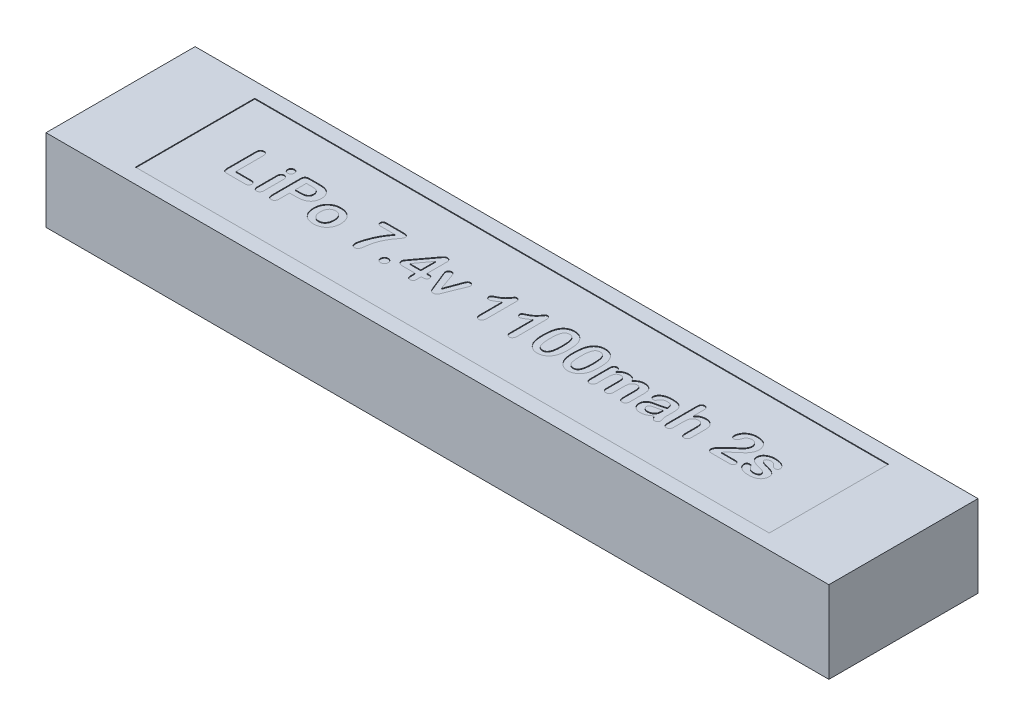
from build123d import *

# Parameters (mm, degrees)
ESBO_O1_W                = 105
ESBO_O1_H                = 20
RESSALTO_EXTRUS_O1_DEPTH = 11
ESBO_O2_W                = 85
ESBO_O2_H                = 16
CORTE_EXTRUS_O1_DEPTH    = 0.1
CORTE_EXTRUS_O2_DEPTH    = 0.2


with BuildPart() as part:
    # Esboço1 → Ressalto-extrusão1 (new body)
    with BuildSketch(Plane(origin=(0, 0, 0), x_dir=(1, 0, 0), z_dir=(0, 1, 0))):
        with Locations((52.5, 10)):
            Rectangle(ESBO_O1_W, ESBO_O1_H)
    extrude(amount=RESSALTO_EXTRUS_O1_DEPTH)

    # Esboço2 → Corte-extrusão1 (cut)
    with BuildSketch(Plane(origin=(0, 11, 0), x_dir=(1, 0, 0), z_dir=(0, 1, 0))):
        with Locations((52.5, 10)):
            Rectangle(ESBO_O2_W, ESBO_O2_H)
    extrude(amount=-CORTE_EXTRUS_O1_DEPTH, mode=Mode.SUBTRACT)

    # Esboço3 → Corte-extrusão2 (cut)
    # profile 1 of 18: a face of its own
    with BuildSketch(Plane(origin=(0, 11, 0), x_dir=(1, 0, 0), z_dir=(0, 1, 0))):
        with BuildLine():
            Line((17.146783244, 11.960447216), (17.146783244, 8.334703573))
            Line((17.146783244, 8.334703573), (19.1853862, 8.334703573))
            add(Edge.make_bspline(
                [(19.1853862, 8.334703573), (19.223658234, 8.333701654), (19.296640648, 8.331791058), (19.398677349, 8.308172729), (19.488069137, 8.271628971), (19.560345413, 8.217285372), (19.61860217, 8.15372303), (19.660912733, 8.081021521), (19.685660887, 7.999852261), (19.688545758, 7.943270379), (19.690020692, 7.914342038)],
                knots=[0, 0, 0, 0, 1.240270116, 2.365118784, 3.381765818, 4.352609133, 5.275186246, 6.165500839, 7.062084633, 8, 8, 8, 8], degree=3))
            add(Edge.make_bspline(
                [(19.690020692, 7.914342038), (19.688605798, 7.884736027), (19.685868847, 7.827466546), (19.660883148, 7.745672979), (19.619074472, 7.673516632), (19.56155617, 7.61129835), (19.489370078, 7.559871189), (19.400386398, 7.525723925), (19.29788922, 7.502975865), (19.224321482, 7.501029894), (19.1853862, 7.5)],
                knots=[0, 0, 0, 0, 0.961785517, 1.860465312, 2.752861249, 3.654173772, 4.599371787, 5.609990076, 6.735101654, 8, 8, 8, 8], degree=3))
            Line((19.1853862, 7.5), (16.773574435, 7.5))
            add(Edge.make_bspline(
                [(16.773574435, 7.5), (16.724562991, 7.50128235), (16.633284969, 7.503670577), (16.507389534, 7.532366113), (16.401547561, 7.576364246), (16.317214582, 7.643237049), (16.255057712, 7.732313053), (16.212524717, 7.842262744), (16.188480375, 7.973844815), (16.185342793, 8.068402835), (16.183663737, 8.119004933)],
                knots=[0, 0, 0, 0, 1.184943227, 2.206816713, 3.109923682, 3.939837529, 4.776053014, 5.71019795, 6.774627611, 8, 8, 8, 8], degree=3))
            Line((16.183663737, 8.119004933), (16.183663737, 11.960447216))
            add(Edge.make_bspline(
                [(16.183663737, 11.960447216), (16.184904679, 12.008394203), (16.18724162, 12.098687962), (16.212133279, 12.224518095), (16.253115763, 12.331783001), (16.310819856, 12.420102396), (16.383319505, 12.48819951), (16.466268131, 12.537997869), (16.560403952, 12.566668717), (16.62623847, 12.570468712), (16.660207243, 12.572429403)],
                knots=[0, 0, 0, 0, 1.312227502, 2.471186598, 3.495416453, 4.440711492, 5.33513045, 6.197779038, 7.0701043, 8, 8, 8, 8], degree=3))
            add(Edge.make_bspline(
                [(16.660207243, 12.572429403), (16.694898725, 12.571027031), (16.762276609, 12.568303341), (16.857542796, 12.537456032), (16.942987283, 12.48986428), (17.016369766, 12.421861843), (17.076991642, 12.334875544), (17.118217338, 12.226894898), (17.143337126, 12.100052674), (17.145582947, 12.009072359), (17.146783244, 11.960447216)],
                knots=[0, 0, 0, 0, 0.937651975, 1.821110013, 2.686129292, 3.571911612, 4.510265029, 5.535848738, 6.683015045, 8, 8, 8, 8], degree=3))
        make_face()
    # profile 2 of 18: a face of its own
    with BuildSketch(Plane(origin=(0, 11, 0), x_dir=(1, 0, 0), z_dir=(0, 1, 0))):
        with BuildLine():
            Line((21.25609314, 10.640170892), (21.25609314, 7.992595498))
            add(Edge.make_bspline(
                [(21.25609314, 7.992595498), (21.254757568, 7.949329705), (21.252238381, 7.867720714), (21.228307873, 7.753520887), (21.188213375, 7.655553002), (21.131576113, 7.575198584), (21.061998643, 7.513046701), (20.983275989, 7.467605472), (20.894930277, 7.440884659), (20.833235917, 7.437517505), (20.801621122, 7.435792033)],
                knots=[0, 0, 0, 0, 1.279660949, 2.41372764, 3.434282009, 4.393028164, 5.297478756, 6.175532382, 7.06506577, 8, 8, 8, 8], degree=3))
            add(Edge.make_bspline(
                [(20.801621122, 7.435792033), (20.769956315, 7.437345348), (20.708704792, 7.440350037), (20.621660683, 7.469061913), (20.543857535, 7.514785787), (20.476931235, 7.579513173), (20.422121816, 7.660503059), (20.384497192, 7.758260641), (20.361239683, 7.870449807), (20.358585731, 7.950332061), (20.3571816, 7.992595498)],
                knots=[0, 0, 0, 0, 0.944656094, 1.82731652, 2.710883517, 3.62364324, 4.589202842, 5.612771424, 6.736985008, 8, 8, 8, 8], degree=3))
            Line((20.3571816, 7.992595498), (20.3571816, 10.613083156))
            add(Edge.make_bspline(
                [(20.3571816, 10.613083156), (20.358617932, 10.655671004), (20.36133377, 10.736196779), (20.384021205, 10.848567083), (20.421935545, 10.945087273), (20.476995891, 11.02342525), (20.544325405, 11.084928573), (20.621804106, 11.128853001), (20.709054492, 11.154756281), (20.770008025, 11.158113124), (20.801621122, 11.159854126)],
                knots=[0, 0, 0, 0, 1.282601348, 2.425162879, 3.437763456, 4.38569495, 5.284727511, 6.164859808, 7.048218153, 8, 8, 8, 8], degree=3))
            add(Edge.make_bspline(
                [(20.801621122, 11.159854126), (20.833215657, 11.158040287), (20.894775368, 11.154506152), (20.983157504, 11.129128873), (21.062023089, 11.084720583), (21.130580777, 11.023795049), (21.187790771, 10.947901638), (21.227682428, 10.85654311), (21.252122837, 10.752466563), (21.254728297, 10.678773981), (21.25609314, 10.640170892)],
                knots=[0, 0, 0, 0, 0.975882645, 1.901438153, 2.812865763, 3.75006033, 4.717368935, 5.725761173, 6.808663735, 8, 8, 8, 8], degree=3))
        make_face()
    # profile 3 of 18: a face of its own
    with BuildSketch(Plane(origin=(0, 11, 0), x_dir=(1, 0, 0), z_dir=(0, 1, 0))):
        with BuildLine():
            add(Edge.make_bspline(
                [(20.811653617, 11.609309896), (20.78141119, 11.610492998), (20.722402292, 11.612801463), (20.637231974, 11.635867233), (20.55925861, 11.673579116), (20.488396661, 11.724411184), (20.429496426, 11.790090612), (20.386334179, 11.869590263), (20.361086043, 11.961610932), (20.35851785, 12.0268354), (20.3571816, 12.060772165)],
                knots=[0, 0, 0, 0, 1.006201835, 1.963296869, 2.915511555, 3.880878732, 4.85189213, 5.829536295, 6.870691953, 8, 8, 8, 8], degree=3))
            add(Edge.make_bspline(
                [(20.3571816, 12.060772165), (20.358956235, 12.092042877), (20.362395473, 12.152645443), (20.388120993, 12.239633928), (20.432349838, 12.316905864), (20.491805262, 12.384074708), (20.562477845, 12.438213945), (20.639605125, 12.480003463), (20.724025226, 12.50352618), (20.782087432, 12.506637237), (20.811653617, 12.508221436)],
                knots=[0, 0, 0, 0, 1.057408726, 2.04925565, 3.037480321, 4.047814229, 5.064214746, 6.036169889, 6.999986943, 8, 8, 8, 8], degree=3))
            add(Edge.make_bspline(
                [(20.811653617, 12.508221436), (20.840218156, 12.506946903), (20.896160195, 12.504450804), (20.977566685, 12.482329699), (21.053337388, 12.445844979), (21.122462405, 12.395517182), (21.183572925, 12.33276016), (21.225283841, 12.252907981), (21.252897697, 12.161234436), (21.254990309, 12.095444322), (21.25609314, 12.060772165)],
                knots=[0, 0, 0, 0, 0.967133894, 1.894077239, 2.837452275, 3.803721558, 4.782485793, 5.777084342, 6.828497526, 8, 8, 8, 8], degree=3))
            add(Edge.make_bspline(
                [(21.25609314, 12.060772165), (21.254801276, 12.027144427), (21.252318959, 11.962528672), (21.2264544, 11.871665087), (21.185052766, 11.791724712), (21.125583545, 11.726852719), (21.056850539, 11.674945175), (20.980706284, 11.636972758), (20.898420566, 11.612598846), (20.840920078, 11.610419257), (20.811653617, 11.609309896)],
                knots=[0, 0, 0, 0, 1.133982342, 2.178948973, 3.165031597, 4.149752721, 5.126395816, 6.06160272, 7.013399203, 8, 8, 8, 8], degree=3))
        make_face()
    # profile 4 of 18: a face of its own
    with BuildSketch(Plane(origin=(0, 11, 0), x_dir=(1, 0, 0), z_dir=(0, 1, 0))):
        with BuildLine():
            Line((24.153477656, 9.426239014), (23.24654012, 9.426239014))
            Line((23.24654012, 9.426239014), (23.24654012, 8.040751473))
            add(Edge.make_bspline(
                [(23.24654012, 8.040751473), (23.245384694, 7.99411485), (23.243194091, 7.905695288), (23.216783752, 7.78235768), (23.175200425, 7.675410611), (23.11415613, 7.588592345), (23.0410727, 7.520197704), (22.958172627, 7.470445495), (22.865144274, 7.441619521), (22.800291607, 7.437769296), (22.766986866, 7.435792033)],
                knots=[0, 0, 0, 0, 1.285699921, 2.437591255, 3.464765735, 4.43309728, 5.341309432, 6.21076238, 7.081146562, 8, 8, 8, 8], degree=3))
            add(Edge.make_bspline(
                [(22.766986866, 7.435792033), (22.73236297, 7.437771995), (22.665243337, 7.44161022), (22.569306966, 7.469930495), (22.485451496, 7.520026184), (22.411678582, 7.586922265), (22.352715362, 7.674083446), (22.312270994, 7.780103737), (22.287028217, 7.902795624), (22.284667267, 7.990452811), (22.283420614, 8.036738475)],
                knots=[0, 0, 0, 0, 0.952842406, 1.847118322, 2.721986042, 3.621319613, 4.568808427, 5.589565879, 6.727217387, 8, 8, 8, 8], degree=3))
            Line((22.283420614, 8.036738475), (22.283420614, 11.833034531))
            add(Edge.make_bspline(
                [(22.283420614, 11.833034531), (22.283699704, 11.859469547), (22.284237788, 11.910436042), (22.29133566, 11.98423981), (22.303235346, 12.051964663), (22.319173395, 12.114225948), (22.339974736, 12.170094221), (22.365418534, 12.220336025), (22.395385882, 12.264871063), (22.443339191, 12.316525335), (22.518076501, 12.370603127), (22.628324452, 12.413924141), (22.759460097, 12.439615205), (22.853803813, 12.442477473), (22.904432046, 12.444013468)],
                knots=[0, 0, 0, 0, 0.941718592, 1.815625801, 2.638480297, 3.389986758, 4.102699286, 4.758224476, 5.39283612, 6.008479495, 7.262224214, 8.640906231, 10.197389428, 12, 12, 12, 12], degree=3))
            Line((22.904432046, 12.444013468), (24.162506901, 12.444013468))
            add(Edge.make_bspline(
                [(24.162506901, 12.444013468), (24.207659783, 12.444022107), (24.29532156, 12.444038879), (24.422743004, 12.438419886), (24.542143632, 12.431460816), (24.653683354, 12.423126133), (24.757080868, 12.409977813), (24.852343152, 12.393688345), (24.939984135, 12.37641623), (24.994949493, 12.36107325), (25.021288462, 12.353721015)],
                knots=[0, 0, 0, 0, 1.25088383, 2.428520539, 3.533027188, 4.564878591, 5.52680176, 6.419426011, 7.242601342, 8, 8, 8, 8], degree=3))
            add(Edge.make_bspline(
                [(25.021288462, 12.353721015), (25.071222151, 12.338520529), (25.169453043, 12.308617726), (25.3075138, 12.243871532), (25.436513158, 12.167780209), (25.553516582, 12.076088618), (25.659039048, 11.972931242), (25.751473365, 11.858208321), (25.830100462, 11.732287021), (25.89369974, 11.595098629), (25.945670579, 11.449225601), (25.981005313, 11.293628666), (26.004001626, 11.12944236), (26.006304866, 11.016805142), (26.007482707, 10.959204229)],
                knots=[0, 0, 0, 0, 1.016072159, 1.998844374, 2.963446839, 3.929479405, 4.88809646, 5.833686282, 6.79396355, 7.773575509, 8.775354313, 9.806098629, 10.878073131, 12, 12, 12, 12], degree=3))
            add(Edge.make_bspline(
                [(26.007482707, 10.959204229), (26.006318354, 10.898263511), (26.00405182, 10.779636036), (25.981175133, 10.607414333), (25.945950812, 10.4461243), (25.894458458, 10.29629717), (25.828172356, 10.15818588), (25.747143331, 10.031649305), (25.652131598, 9.916142214), (25.542149291, 9.812476649), (25.417714184, 9.720862658), (25.279334229, 9.640823722), (25.12554867, 9.575544639), (24.958701677, 9.519733063), (24.777044405, 9.478731061), (24.582119517, 9.447278617), (24.372516423, 9.429500652), (24.228085119, 9.42734997), (24.153477656, 9.426239014)],
                knots=[0, 0, 0, 0, 1.064269092, 2.071710987, 3.030014155, 3.944730477, 4.833317459, 5.700512996, 6.563900655, 7.440202656, 8.334248487, 9.258341999, 10.226640684, 11.248485432, 12.328534365, 13.476518405, 14.696469853, 16, 16, 16, 16], degree=3))
        make_face()
        with BuildLine():
            Line((23.913701029, 11.673517863), (23.24654012, 11.673517863))
            Line((23.24654012, 11.673517863), (23.24654012, 10.196734619))
            Line((23.24654012, 10.196734619), (23.913701029, 10.196734619))
            add(Edge.make_bspline(
                [(23.913701029, 10.196734619), (23.969567022, 10.19782725), (24.076777046, 10.199924071), (24.230804241, 10.212157425), (24.370205441, 10.23547877), (24.496064973, 10.265543261), (24.607905111, 10.307340964), (24.705352904, 10.362237374), (24.789904778, 10.427319466), (24.859362751, 10.505287853), (24.915183301, 10.595078828), (24.95215839, 10.698761386), (24.976063919, 10.814321374), (24.97874745, 10.895532545), (24.980155233, 10.93813599)],
                knots=[0, 0, 0, 0, 1.355309994, 2.600917123, 3.743816141, 4.780660951, 5.735811607, 6.62931006, 7.484500426, 8.311764707, 9.149305958, 10.032284453, 10.967734859, 12, 12, 12, 12], degree=3))
            add(Edge.make_bspline(
                [(24.980155233, 10.93813599), (24.977995127, 10.989213058), (24.973831785, 11.087657905), (24.93750089, 11.227791458), (24.879195639, 11.354683598), (24.820019993, 11.424194803), (24.79054108, 11.458822473)],
                knots=[0, 0, 0, 0, 1.078100798, 2.07790835, 3.042491687, 4, 4, 4, 4], degree=3))
            add(Edge.make_bspline(
                [(24.79054108, 11.458822473), (24.770980271, 11.476199962), (24.729857435, 11.512732789), (24.654096352, 11.556828755), (24.563816862, 11.591420448), (24.461253238, 11.623480544), (24.344000674, 11.645167625), (24.213110115, 11.662426844), (24.06801204, 11.672140688), (23.966552051, 11.673046185), (23.913701029, 11.673517863)],
                knots=[0, 0, 0, 0, 0.67948794, 1.428492636, 2.263733299, 3.191206897, 4.220047442, 5.360670486, 6.625159889, 8, 8, 8, 8], degree=3))
        make_face(mode=Mode.SUBTRACT)
    # profile 5 of 18: a face of its own
    with BuildSketch(Plane(origin=(0, 11, 0), x_dir=(1, 0, 0), z_dir=(0, 1, 0))):
        with BuildLine():
            add(Edge.make_bspline(
                [(30.245208537, 9.29581658), (30.243724289, 9.228858311), (30.240805222, 9.097171625), (30.216057855, 8.90378094), (30.176184358, 8.718352923), (30.120008093, 8.541655203), (30.048898278, 8.374951367), (29.963659012, 8.219664004), (29.863289045, 8.076772104), (29.749129893, 7.946760103), (29.622013663, 7.829234825), (29.481848929, 7.727130994), (29.330651138, 7.637908726), (29.167259229, 7.56501579), (28.993129587, 7.506109785), (28.807676725, 7.465945392), (28.612329187, 7.439829136), (28.478573748, 7.437156792), (28.410265226, 7.435792033)],
                knots=[0, 0, 0, 0, 1.091425222, 2.14650367, 3.173246554, 4.180341516, 5.164818684, 6.123963105, 7.063390915, 8.006199165, 8.940071845, 9.880179878, 10.828459563, 11.797350195, 12.792281962, 13.820196984, 14.886780802, 16, 16, 16, 16], degree=3))
            add(Edge.make_bspline(
                [(28.410265226, 7.435792033), (28.342272804, 7.437020282), (28.209435659, 7.439419917), (28.015942809, 7.467306494), (27.831933223, 7.507001226), (27.659424679, 7.566799796), (27.497486147, 7.641518318), (27.346699813, 7.730744087), (27.207385256, 7.834945402), (27.079689252, 7.952347497), (26.964977018, 8.083178169), (26.864697106, 8.22591713), (26.778416191, 8.379656931), (26.708673889, 8.54473022), (26.652973223, 8.719956221), (26.61483537, 8.904926234), (26.589624454, 9.098487948), (26.586796069, 9.23052324), (26.585354411, 9.297823079)],
                knots=[0, 0, 0, 0, 1.111227023, 2.171009928, 3.19145726, 4.186070048, 5.150303806, 6.104321695, 7.046220171, 7.990735544, 8.936485474, 9.886464991, 10.839039205, 11.814379169, 12.812535149, 13.84133354, 14.899703965, 16, 16, 16, 16], degree=3))
            add(Edge.make_bspline(
                [(26.585354411, 9.297823079), (26.586790443, 9.365792644), (26.58960823, 9.49916275), (26.614908575, 9.694699284), (26.652740839, 9.881852656), (26.709685903, 10.058970364), (26.780568414, 10.225759408), (26.86604192, 10.380678167), (26.964677851, 10.523352794), (27.077769523, 10.652598732), (27.204559948, 10.768005844), (27.34395624, 10.870225648), (27.496269633, 10.957488657), (27.660253058, 11.030744802), (27.834860304, 11.089208851), (28.019208657, 11.12954972), (28.211869409, 11.155794002), (28.343293377, 11.158483563), (28.410265226, 11.159854126)],
                knots=[0, 0, 0, 0, 1.109458584, 2.176983352, 3.214831729, 4.223461232, 5.209438476, 6.170044374, 7.10777617, 8.036608407, 8.968213882, 9.902121437, 10.853822319, 11.829170779, 12.830797886, 13.854949514, 14.906911741, 16, 16, 16, 16], degree=3))
            add(Edge.make_bspline(
                [(28.410265226, 11.159854126), (28.478232042, 11.158447532), (28.611638672, 11.155686642), (28.806819403, 11.130014518), (28.992424443, 11.088258651), (29.167386336, 11.02880489), (29.331452788, 10.954116733), (29.484815652, 10.866624752), (29.624165123, 10.761626139), (29.75147914, 10.644310592), (29.867005652, 10.514726106), (29.965963278, 10.371186236), (30.052161499, 10.216995096), (30.122004505, 10.050914763), (30.177030619, 9.87482539), (30.217439602, 9.689951722), (30.240528487, 9.495716755), (30.243625589, 9.363429441), (30.245208537, 9.29581658)],
                knots=[0, 0, 0, 0, 1.106546112, 2.171950929, 3.199928065, 4.200661522, 5.175688508, 6.132331741, 7.070262582, 8.010799296, 8.948477062, 9.891329305, 10.844648531, 11.82089183, 12.82003801, 13.845645933, 14.898896381, 16, 16, 16, 16], degree=3))
        make_face()
        with BuildLine():
            add(Edge.make_bspline(
                [(29.346296997, 9.29581658), (29.345558494, 9.340318823), (29.344123032, 9.42681978), (29.33212091, 9.552608334), (29.311514543, 9.670754984), (29.285828643, 9.782094379), (29.248538826, 9.884942104), (29.206339286, 9.981233889), (29.153142868, 10.068521594), (29.094619067, 10.149277765), (29.027907037, 10.220210722), (28.956719634, 10.283461005), (28.878649894, 10.335430127), (28.795971975, 10.379478129), (28.707008894, 10.41209382), (28.61302809, 10.436646854), (28.51334283, 10.450521677), (28.445085388, 10.452537934), (28.410265226, 10.453566488)],
                knots=[0, 0, 0, 0, 1.270558422, 2.469640054, 3.603049319, 4.693866399, 5.726721989, 6.722451407, 7.690273023, 8.639449843, 9.565088081, 10.465156222, 11.352368502, 12.23649231, 13.133922735, 14.051050542, 15.005782631, 16, 16, 16, 16], degree=3))
            add(Edge.make_bspline(
                [(28.410265226, 10.453566488), (28.365296136, 10.452333646), (28.277556593, 10.449928239), (28.150513692, 10.42202051), (28.030820646, 10.380828079), (27.920872703, 10.319577507), (27.821003153, 10.24302705), (27.731801629, 10.150246997), (27.657308114, 10.039648537), (27.593597153, 9.914863497), (27.545564568, 9.775813563), (27.509012741, 9.62579227), (27.488089367, 9.464282285), (27.485565148, 9.353061227), (27.484265951, 9.29581658)],
                knots=[0, 0, 0, 0, 0.966943267, 1.886610523, 2.788820013, 3.685057501, 4.584069546, 5.490925344, 6.443978365, 7.44584051, 8.500680597, 9.604835001, 10.767226511, 12, 12, 12, 12], degree=3))
            add(Edge.make_bspline(
                [(27.484265951, 9.29581658), (27.485517626, 9.239227794), (27.487948787, 9.129313985), (27.509539956, 8.969718558), (27.543941054, 8.820870146), (27.593211035, 8.683872132), (27.654727399, 8.559983814), (27.730078843, 8.451186155), (27.816456028, 8.356666731), (27.915998961, 8.278869284), (28.025766405, 8.216993173), (28.145891718, 8.173989237), (28.274970904, 8.147029552), (28.364312382, 8.143760903), (28.410265226, 8.142079671)],
                knots=[0, 0, 0, 0, 1.221452891, 2.372458373, 3.470695752, 4.514597835, 5.509283355, 6.448751658, 7.363470559, 8.263476682, 9.165479573, 10.07241203, 11.008543944, 12, 12, 12, 12], degree=3))
            add(Edge.make_bspline(
                [(28.410265226, 8.142079671), (28.445085703, 8.143107764), (28.513343764, 8.145123118), (28.613024585, 8.159004422), (28.707021361, 8.183534134), (28.795926764, 8.21623405), (28.878983297, 8.260061302), (28.956397631, 8.31332482), (29.027968429, 8.37635974), (29.094558083, 8.447418477), (29.153499102, 8.528251575), (29.205760632, 8.6160565), (29.248858771, 8.711891664), (29.285601879, 8.814291969), (29.311561701, 8.924866871), (29.332111686, 9.042033902), (29.344094895, 9.166483324), (29.345550659, 9.251982881), (29.346296997, 9.29581658)],
                knots=[0, 0, 0, 0, 0.996858043, 1.954125933, 2.873689662, 3.773503692, 4.659975762, 5.554937906, 6.457396659, 7.385493423, 8.337191288, 9.315813857, 10.305473609, 11.341072498, 12.425486328, 13.552469893, 14.745206377, 16, 16, 16, 16], degree=3))
        make_face(mode=Mode.SUBTRACT)
    # profile 6 of 18: a face of its own
    with BuildSketch(Plane(origin=(0, 11, 0), x_dir=(1, 0, 0), z_dir=(0, 1, 0))):
        with BuildLine():
            Line((33.309132468, 12.444013468), (35.542365824, 12.444013468))
            add(Edge.make_bspline(
                [(35.542365824, 12.444013468), (35.592255127, 12.443082226), (35.685436855, 12.441342879), (35.814130871, 12.423274344), (35.921306065, 12.391756218), (36.007931947, 12.346610248), (36.074675497, 12.284863711), (36.120959142, 12.206184184), (36.148026358, 12.111327705), (36.150845642, 12.042902222), (36.152341512, 12.006596692)],
                knots=[0, 0, 0, 0, 1.387522966, 2.591573344, 3.604033482, 4.482526668, 5.285646256, 6.099474578, 6.991609855, 8, 8, 8, 8], degree=3))
            add(Edge.make_bspline(
                [(36.152341512, 12.006596692), (36.149684885, 11.980628448), (36.143841588, 11.923510831), (36.109595067, 11.834147532), (36.055131767, 11.734635706), (35.980404128, 11.625956969), (35.894384088, 11.507425659), (35.798864779, 11.382403153), (35.701042316, 11.248600905), (35.593336318, 11.110330862), (35.484460094, 10.9589779), (35.373686925, 10.791855141), (35.262057073, 10.607001994), (35.146711885, 10.405473168), (35.033682767, 10.183170163), (34.927058019, 9.937213972), (34.823163704, 9.668796421), (34.76221741, 9.479745818), (34.73073699, 9.382096036)],
                knots=[0, 0, 0, 0, 0.414959502, 0.912710815, 1.511791848, 2.223499158, 3.01423818, 3.848620571, 4.733156334, 5.658253859, 6.644334387, 7.706720731, 8.855897973, 10.088680458, 11.410460398, 12.831844062, 14.363561227, 16, 16, 16, 16], degree=3))
            add(Edge.make_bspline(
                [(34.73073699, 9.382096036), (34.71815696, 9.33934856), (34.694240318, 9.258078799), (34.663307735, 9.14120959), (34.636716317, 9.036042722), (34.61582475, 8.937954866), (34.598535252, 8.839080546), (34.579942186, 8.731528811), (34.562827809, 8.610216082), (34.542880945, 8.480929863), (34.5252039, 8.352976758), (34.507123541, 8.236929364), (34.490452977, 8.137517529), (34.478382629, 8.07717866), (34.472901872, 8.049780718)],
                knots=[0, 0, 0, 0, 1.180707814, 2.244713649, 3.203270886, 4.054896123, 4.901388395, 5.862890264, 6.9469293, 8.147521687, 9.329293142, 10.369527441, 11.259654788, 12, 12, 12, 12], degree=3))
            add(Edge.make_bspline(
                [(34.472901872, 8.049780718), (34.460850759, 7.996348453), (34.438440331, 7.896985028), (34.392876798, 7.762263844), (34.339789075, 7.653267412), (34.277409374, 7.569196074), (34.20476617, 7.508263901), (34.12277765, 7.465321466), (34.029311958, 7.439638453), (33.963417964, 7.437108228), (33.92914065, 7.435792033)],
                knots=[0, 0, 0, 0, 1.451874053, 2.699926298, 3.762840371, 4.655029763, 5.454416663, 6.255719795, 7.092645078, 8, 8, 8, 8], degree=3))
            add(Edge.make_bspline(
                [(33.92914065, 7.435792033), (33.896494923, 7.437376118), (33.833322489, 7.440441467), (33.743693747, 7.468549589), (33.664488079, 7.514833729), (33.596116409, 7.579272528), (33.541213909, 7.662110542), (33.503597608, 7.763279373), (33.480841407, 7.880559123), (33.478114631, 7.964391408), (33.476675132, 8.00864749)],
                knots=[0, 0, 0, 0, 0.947376491, 1.833259175, 2.700585026, 3.594967618, 4.541694999, 5.563884298, 6.713944918, 8, 8, 8, 8], degree=3))
            add(Edge.make_bspline(
                [(33.476675132, 8.00864749), (33.478081044, 8.04848908), (33.481127582, 8.134823718), (33.499785911, 8.273761992), (33.528052589, 8.432032151), (33.567367252, 8.609885409), (33.61958395, 8.806890212), (33.68772589, 9.021908315), (33.767867604, 9.256373912), (33.862767036, 9.506532963), (33.969199328, 9.768843606), (34.092787756, 10.034909464), (34.225821935, 10.305971284), (34.373629002, 10.579035915), (34.533149699, 10.85515911), (34.709454842, 11.129669639), (34.898678009, 11.404121726), (35.034358494, 11.583065161), (35.102942549, 11.673517863)],
                knots=[0, 0, 0, 0, 0.471260724, 1.021197269, 1.655847885, 2.372701768, 3.174729728, 4.065420368, 5.039777001, 6.104946692, 7.22944111, 8.386888566, 9.573763107, 10.800101985, 12.058467616, 13.344353721, 14.657618372, 16, 16, 16, 16], degree=3))
            Line((35.102942549, 11.673517863), (33.309132468, 11.673517863))
            add(Edge.make_bspline(
                [(33.309132468, 11.673517863), (33.264899971, 11.674362168), (33.182309849, 11.675938638), (33.06695391, 11.695338414), (32.968888563, 11.725185501), (32.887239638, 11.768381696), (32.824511871, 11.827715181), (32.780151949, 11.901874053), (32.754037077, 11.990189401), (32.750943966, 12.053566638), (32.749319255, 12.086856651)],
                knots=[0, 0, 0, 0, 1.333631744, 2.490133156, 3.517920304, 4.416864083, 5.252135053, 6.089902374, 6.996687486, 8, 8, 8, 8], degree=3))
            add(Edge.make_bspline(
                [(32.749319255, 12.086856651), (32.750540621, 12.121571833), (32.752785561, 12.185380298), (32.781518025, 12.27151643), (32.828506402, 12.339316048), (32.89859052, 12.382116002), (32.98128084, 12.409385219), (33.077454958, 12.430689947), (33.188476838, 12.441945498), (33.267307396, 12.44329661), (33.309132468, 12.444013468)],
                knots=[0, 0, 0, 0, 1.083149567, 1.990890062, 2.808092905, 3.610044926, 4.511354778, 5.530609725, 6.689817374, 8, 8, 8, 8], degree=3))
        make_face()
    # profile 7 of 18: a face of its own
    with BuildSketch(Plane(origin=(0, 11, 0), x_dir=(1, 0, 0), z_dir=(0, 1, 0))):
        with BuildLine():
            add(Edge.make_bspline(
                [(37.441517102, 7.435792033), (37.407253135, 7.437588419), (37.340441345, 7.441091218), (37.243464989, 7.466941726), (37.154727427, 7.51088755), (37.073742987, 7.569865337), (37.005953978, 7.64509008), (36.956429074, 7.735943012), (36.928390277, 7.84115163), (36.924746424, 7.915509814), (36.922837118, 7.954472017)],
                knots=[0, 0, 0, 0, 0.998960509, 1.947887116, 2.903410511, 3.873171148, 4.854298939, 5.832220262, 6.864126722, 8, 8, 8, 8], degree=3))
            add(Edge.make_bspline(
                [(36.922837118, 7.954472017), (36.92436882, 7.988146699), (36.927382178, 8.054395794), (36.957471033, 8.149163247), (37.002674844, 8.23750443), (37.06767376, 8.314884314), (37.14437869, 8.380963142), (37.232511655, 8.429083785), (37.329290777, 8.458617753), (37.396826582, 8.461592782), (37.431484607, 8.463119507)],
                knots=[0, 0, 0, 0, 1.007642753, 1.982362345, 2.956461756, 3.969040175, 4.994467835, 5.978033734, 6.962367344, 8, 8, 8, 8], degree=3))
            add(Edge.make_bspline(
                [(37.431484607, 8.463119507), (37.466155978, 8.461600126), (37.534039312, 8.458625319), (37.631338807, 8.428644481), (37.721430775, 8.382536417), (37.799485818, 8.316255827), (37.867219801, 8.239973392), (37.914552823, 8.151464226), (37.946032534, 8.055908515), (37.948764544, 7.988841324), (37.950164591, 7.954472017)],
                knots=[0, 0, 0, 0, 1.02791515, 2.012562649, 2.999766571, 4.016855155, 5.039129662, 6.013484395, 6.981988622, 8, 8, 8, 8], degree=3))
            add(Edge.make_bspline(
                [(37.950164591, 7.954472017), (37.948834491, 7.916106328), (37.946282156, 7.842486281), (37.915494535, 7.739001915), (37.868758409, 7.646849544), (37.79989805, 7.57233041), (37.721118881, 7.51225424), (37.634198424, 7.468059464), (37.540107547, 7.440889555), (37.474805291, 7.437513166), (37.441517102, 7.435792033)],
                knots=[0, 0, 0, 0, 1.129257942, 2.166936788, 3.16083936, 4.153956704, 5.133579105, 6.074251673, 7.018339047, 8, 8, 8, 8], degree=3))
        make_face()
    # profile 8 of 18: a face of its own
    with BuildSketch(Plane(origin=(0, 11, 0), x_dir=(1, 0, 0), z_dir=(0, 1, 0))):
        with BuildLine():
            Line((40.967939046, 7.926381032), (40.967939046, 8.527327474))
            Line((40.967939046, 8.527327474), (39.268434416, 8.527327474))
            add(Edge.make_bspline(
                [(39.268434416, 8.527327474), (39.218159533, 8.528898395), (39.123135513, 8.531867577), (38.989931572, 8.557976912), (38.87693737, 8.60480483), (38.782713842, 8.668151107), (38.711826928, 8.750542722), (38.660033613, 8.845445073), (38.629480978, 8.954209225), (38.626104532, 9.031095616), (38.624348246, 9.071088696)],
                knots=[0, 0, 0, 0, 1.25942754, 2.38043053, 3.379717692, 4.307336712, 5.198261048, 6.075839829, 6.999132492, 8, 8, 8, 8], degree=3))
            add(Edge.make_bspline(
                [(38.624348246, 9.071088696), (38.625519206, 9.092953677), (38.627900051, 9.137410485), (38.647779639, 9.204288037), (38.678377519, 9.272689976), (38.719791964, 9.342700846), (38.766874784, 9.412742979), (38.818987282, 9.484582109), (38.877727237, 9.562683076), (38.920245082, 9.617906685), (38.943381583, 9.64795715)],
                knots=[0, 0, 0, 0, 0.781999668, 1.589994848, 2.48037944, 3.462579725, 4.499233466, 5.503326527, 6.64141076, 8, 8, 8, 8], degree=3))
            Line((38.943381583, 9.64795715), (40.737191664, 12.056759167))
            add(Edge.make_bspline(
                [(40.737191664, 12.056759167), (40.765071073, 12.093708978), (40.817299754, 12.162929953), (40.893489283, 12.257360914), (40.961282301, 12.335807575), (41.022547659, 12.399636003), (41.082840577, 12.449683123), (41.148918491, 12.483336308), (41.220171761, 12.504177774), (41.269774344, 12.506858318), (41.294998379, 12.508221436)],
                knots=[0, 0, 0, 0, 1.48844063, 2.788412437, 3.901253862, 4.821415886, 5.632629509, 6.407008358, 7.189927726, 8, 8, 8, 8], degree=3))
            add(Edge.make_bspline(
                [(41.294998379, 12.508221436), (41.334996233, 12.50685315), (41.410445001, 12.504272125), (41.515774199, 12.475380716), (41.605637563, 12.428677787), (41.680058648, 12.362986972), (41.736474108, 12.277355301), (41.774612341, 12.173710137), (41.79896302, 12.052523968), (41.801364184, 11.965596266), (41.802642619, 11.919313987)],
                knots=[0, 0, 0, 0, 1.076963546, 2.031498291, 2.919605356, 3.788945032, 4.67998164, 5.6570307, 6.752550053, 8, 8, 8, 8], degree=3))
            Line((41.802642619, 11.919313987), (41.802642619, 9.297823079))
            Line((41.802642619, 9.297823079), (41.948113794, 9.297823079))
            add(Edge.make_bspline(
                [(41.948113794, 9.297823079), (41.989636976, 9.29736645), (42.068273068, 9.296501692), (42.179672165, 9.281735622), (42.278636945, 9.26058632), (42.365534992, 9.229789677), (42.439610617, 9.182430576), (42.490541143, 9.109169446), (42.519369175, 9.015631558), (42.52235576, 8.946914145), (42.523978999, 8.909565528)],
                knots=[0, 0, 0, 0, 1.242863869, 2.353720375, 3.359907075, 4.269771506, 5.106129909, 5.945781664, 6.88351134, 8, 8, 8, 8], degree=3))
            add(Edge.make_bspline(
                [(42.523978999, 8.909565528), (42.522654212, 8.878292423), (42.52015761, 8.819357304), (42.495813422, 8.737038453), (42.453778991, 8.668826088), (42.394814534, 8.614764842), (42.320336606, 8.57441979), (42.230264727, 8.547237435), (42.124976028, 8.530391115), (42.049513985, 8.52839232), (42.009312013, 8.527327474)],
                knots=[0, 0, 0, 0, 1.022565149, 1.927055163, 2.778227926, 3.615397726, 4.51769584, 5.529346864, 6.683773693, 8, 8, 8, 8], degree=3))
            Line((42.009312013, 8.527327474), (41.802642619, 8.527327474))
            Line((41.802642619, 8.527327474), (41.802642619, 7.926381032))
            add(Edge.make_bspline(
                [(41.802642619, 7.926381032), (41.801469397, 7.887487412), (41.799264592, 7.814395682), (41.778526924, 7.711936807), (41.742758799, 7.625333564), (41.69269826, 7.55465571), (41.629483978, 7.501695849), (41.557041907, 7.46239123), (41.473800326, 7.44051959), (41.415509754, 7.437406116), (41.385290833, 7.435792033)],
                knots=[0, 0, 0, 0, 1.274432738, 2.395007076, 3.407320294, 4.326483834, 5.205518881, 6.088648835, 7.009119863, 8, 8, 8, 8], degree=3))
            add(Edge.make_bspline(
                [(41.385290833, 7.435792033), (41.355364182, 7.437255649), (41.297881606, 7.440066937), (41.215934799, 7.463946223), (41.143547344, 7.503885326), (41.080239874, 7.55870937), (41.02909692, 7.629580984), (40.993314568, 7.716053413), (40.971082639, 7.816584641), (40.969024631, 7.888464781), (40.967939046, 7.926381032)],
                knots=[0, 0, 0, 0, 0.984539267, 1.891085414, 2.783596656, 3.689473023, 4.628317813, 5.635228209, 6.752600069, 8, 8, 8, 8], degree=3))
        make_face()
        Polygon((39.512224042, 9.297823079), (40.967939046, 9.297823079), (40.967939046, 11.28827006), align=None, mode=Mode.SUBTRACT)
    # profile 9 of 18: a face of its own
    with BuildSketch(Plane(origin=(0, 11, 0), x_dir=(1, 0, 0), z_dir=(0, 1, 0))):
        with BuildLine():
            Line((43.761988866, 10.593018166), (44.499377238, 8.527327474))
            Line((44.499377238, 8.527327474), (45.293950831, 10.68331062))
            add(Edge.make_bspline(
                [(45.293950831, 10.68331062), (45.308820985, 10.723642482), (45.336532632, 10.798803931), (45.382686973, 10.900809498), (45.428145561, 10.98397044), (45.473629125, 11.051205954), (45.527332673, 11.101344042), (45.591660629, 11.136314887), (45.668013917, 11.156186804), (45.722552013, 11.158584454), (45.751432597, 11.159854126)],
                knots=[0, 0, 0, 0, 1.438294611, 2.6803698, 3.742400998, 4.608871506, 5.385061347, 6.17643287, 7.034332162, 8, 8, 8, 8], degree=3))
            add(Edge.make_bspline(
                [(45.751432597, 11.159854126), (45.779336956, 11.158637017), (45.834069145, 11.156249754), (45.912793878, 11.13344925), (45.984250403, 11.095193016), (46.047956508, 11.04455394), (46.100123742, 10.983821568), (46.141290581, 10.918234263), (46.163778533, 10.845565107), (46.167100513, 10.795812365), (46.168784383, 10.770593325)],
                knots=[0, 0, 0, 0, 1.058045694, 2.075272735, 3.081014328, 4.120521346, 5.146985688, 6.109861079, 7.041912347, 8, 8, 8, 8], degree=3))
            add(Edge.make_bspline(
                [(46.168784383, 10.770593325), (46.16779489, 10.748761172), (46.165623353, 10.700848422), (46.146829765, 10.628168821), (46.124966365, 10.552353166), (46.096430131, 10.477619025), (46.065043212, 10.400093469), (46.043687614, 10.346564873), (46.032342453, 10.318127807)],
                knots=[0, 0, 0, 0, 0.825929479, 1.812581261, 2.83069787, 3.81678011, 4.840164433, 6, 6, 6, 6], degree=3))
            Line((46.032342453, 10.318127807), (45.157508901, 8.137063424))
            add(Edge.make_bspline(
                [(45.157508901, 8.137063424), (45.143449285, 8.10161891), (45.111849573, 8.021955543), (45.062543052, 7.896718805), (45.006041983, 7.767840289), (44.936563652, 7.653452632), (44.855794243, 7.557988736), (44.772442478, 7.499943925), (44.698838219, 7.466343675), (44.637520156, 7.447792526), (44.570220619, 7.43852714), (44.523478424, 7.436722527), (44.499377238, 7.435792033)],
                knots=[0, 0, 0, 0, 1.099847621, 2.471964112, 3.883426069, 5.152382308, 6.321178163, 7.463888368, 8.046671906, 8.650933988, 9.304395288, 10, 10, 10, 10], degree=3))
            add(Edge.make_bspline(
                [(44.499377238, 7.435792033), (44.468538356, 7.436983623), (44.410081881, 7.439242336), (44.326604854, 7.455225589), (44.253164469, 7.482977529), (44.189587259, 7.522091293), (44.136964822, 7.568530149), (44.089593186, 7.61589758), (44.050613034, 7.665821906), (44.016570246, 7.722171258), (43.98391973, 7.792937368), (43.942609056, 7.884623702), (43.891441067, 8.00188304), (43.855139124, 8.089178452), (43.835226078, 8.137063424)],
                knots=[0, 0, 0, 0, 1.062436898, 2.013896448, 2.914888335, 3.752879434, 4.570334705, 5.328190784, 6.058927147, 6.746693048, 7.591942349, 8.742125367, 10.21292741, 12, 12, 12, 12], degree=3))
            Line((43.835226078, 8.137063424), (42.966412023, 10.294049819))
            add(Edge.make_bspline(
                [(42.966412023, 10.294049819), (42.956589363, 10.320885071), (42.936860968, 10.37478253), (42.903306783, 10.454503911), (42.874565513, 10.53613636), (42.850696385, 10.616937486), (42.833464033, 10.692646426), (42.831060934, 10.741427394), (42.829970093, 10.763570579)],
                knots=[0, 0, 0, 0, 1.04656131, 2.101973795, 3.167361576, 4.213922887, 5.189244559, 6, 6, 6, 6], degree=3))
            add(Edge.make_bspline(
                [(42.829970093, 10.763570579), (42.832813408, 10.795459721), (42.838682442, 10.861283736), (42.884231754, 10.954371494), (42.951512224, 11.038713825), (43.027335347, 11.093135485), (43.093819614, 11.128001181), (43.147756716, 11.145856798), (43.203357535, 11.157412122), (43.241244707, 11.159035103), (43.260364122, 11.159854126)],
                knots=[0, 0, 0, 0, 1.185194173, 2.446420137, 3.794200003, 5.175995176, 5.889892515, 6.587928386, 7.287410964, 8, 8, 8, 8], degree=3))
            add(Edge.make_bspline(
                [(43.260364122, 11.159854126), (43.295647883, 11.15861046), (43.36084825, 11.156312307), (43.450481394, 11.132350926), (43.523184075, 11.090944297), (43.577058341, 11.027815834), (43.620212852, 10.947703704), (43.666890745, 10.849731508), (43.71409842, 10.728956357), (43.745224005, 10.640605629), (43.761988866, 10.593018166)],
                knots=[0, 0, 0, 0, 1.019113123, 1.88320485, 2.659964331, 3.400172946, 4.250057062, 5.289011899, 6.539807782, 8, 8, 8, 8], degree=3))
        make_face()
    # profile 10 of 18: a face of its own
    with BuildSketch(Plane(origin=(0, 11, 0), x_dir=(1, 0, 0), z_dir=(0, 1, 0))):
        with BuildLine():
            Line((50.149678345, 7.979553254), (50.149678345, 11.031438192))
            add(Edge.make_bspline(
                [(50.149678345, 11.031438192), (50.081398253, 10.980894475), (49.951678572, 10.88487066), (49.763068369, 10.75425716), (49.591842304, 10.643645393), (49.43846471, 10.552866612), (49.302917552, 10.481333474), (49.184405831, 10.430674954), (49.083000397, 10.397165365), (49.019862061, 10.391753039), (48.991928438, 10.389358521)],
                knots=[0, 0, 0, 0, 1.524937543, 2.897102299, 4.117716838, 5.183344192, 6.096256202, 6.865612508, 7.498124991, 8, 8, 8, 8], degree=3))
            add(Edge.make_bspline(
                [(48.991928438, 10.389358521), (48.968697888, 10.390688624), (48.922587165, 10.393328771), (48.855540504, 10.415422107), (48.793918071, 10.452795816), (48.737368929, 10.501387345), (48.689462858, 10.559520633), (48.655156729, 10.624874417), (48.632593542, 10.694223587), (48.630039541, 10.742330603), (48.628752124, 10.766580327)],
                knots=[0, 0, 0, 0, 0.963758048, 1.912980161, 2.897257599, 3.941784678, 4.998716957, 6.005782735, 6.994757487, 8, 8, 8, 8], degree=3))
            add(Edge.make_bspline(
                [(48.628752124, 10.766580327), (48.629987998, 10.793812869), (48.632315917, 10.845108666), (48.652591683, 10.916705873), (48.687025889, 10.976987138), (48.739038797, 11.025579258), (48.807091243, 11.070103296), (48.892798872, 11.119467466), (48.999451539, 11.174906485), (49.077757265, 11.212594469), (49.120344372, 11.233091338)],
                knots=[0, 0, 0, 0, 0.899430953, 1.694187344, 2.437953336, 3.16549883, 4.02470575, 5.125223224, 6.436532887, 8, 8, 8, 8], degree=3))
            add(Edge.make_bspline(
                [(49.120344372, 11.233091338), (49.185613311, 11.265111185), (49.310888408, 11.326569046), (49.485300281, 11.427199717), (49.639310107, 11.530273751), (49.775060554, 11.637082468), (49.895948376, 11.749315582), (50.006937301, 11.867063301), (50.112134183, 11.98972977), (50.192227963, 12.096396985), (50.250397258, 12.181593626), (50.291630792, 12.237896867), (50.327610747, 12.28898502), (50.3610507, 12.332387888), (50.388601026, 12.370834277), (50.413046994, 12.401994414), (50.432743491, 12.42706018), (50.454499465, 12.45224376), (50.48557138, 12.477642769), (50.534598517, 12.495621751), (50.594652081, 12.50616554), (50.638538712, 12.507498538), (50.662338832, 12.508221436)],
                knots=[0, 0, 0, 0, 2.123034758, 4.074884479, 5.87647691, 7.531671309, 9.114587021, 10.689919895, 12.255836833, 13.832380571, 14.582986708, 15.268831144, 15.870649267, 16.407884949, 16.868947399, 17.251894771, 17.564620845, 17.799863546, 18.223953356, 18.719139771, 19.305377836, 20, 20, 20, 20], degree=3))
            add(Edge.make_bspline(
                [(50.662338832, 12.508221436), (50.690265987, 12.506425811), (50.744321421, 12.502950223), (50.821784715, 12.47751194), (50.88787984, 12.431006034), (50.946193161, 12.370195052), (50.991341919, 12.292871119), (51.02665063, 12.203148201), (51.044377285, 12.099235627), (51.047137538, 12.02604517), (51.048589884, 11.987534952)],
                knots=[0, 0, 0, 0, 0.921243016, 1.783145896, 2.64927658, 3.562488144, 4.542770888, 5.583775906, 6.728668739, 8, 8, 8, 8], degree=3))
            Line((51.048589884, 11.987534952), (51.048589884, 8.115995185))
            add(Edge.make_bspline(
                [(51.048589884, 8.115995185), (51.047435745, 8.062737946), (51.045269349, 7.962770559), (51.024592109, 7.82352112), (50.990770966, 7.704496435), (50.939854708, 7.607179431), (50.876235368, 7.528377158), (50.795100787, 7.473807264), (50.699762748, 7.44161269), (50.631835969, 7.437797709), (50.596124366, 7.435792033)],
                knots=[0, 0, 0, 0, 1.380618488, 2.591512956, 3.642588447, 4.573860471, 5.42354155, 6.241592279, 7.075540472, 8, 8, 8, 8], degree=3))
            add(Edge.make_bspline(
                [(50.596124366, 7.435792033), (50.563848855, 7.437520736), (50.501915708, 7.440837927), (50.413542044, 7.466550213), (50.33588524, 7.510780336), (50.268392675, 7.571917149), (50.214595235, 7.650913342), (50.176773558, 7.746428525), (50.153706582, 7.857747737), (50.151075897, 7.937294179), (50.149678345, 7.979553254)],
                knots=[0, 0, 0, 0, 0.972556582, 1.866228868, 2.747000637, 3.646686402, 4.589551332, 5.602887627, 6.72653322, 8, 8, 8, 8], degree=3))
        make_face()
    # profile 11 of 18: a face of its own
    with BuildSketch(Plane(origin=(0, 11, 0), x_dir=(1, 0, 0), z_dir=(0, 1, 0))):
        with BuildLine():
            Line((54.258988241, 7.979553254), (54.258988241, 11.031438192))
            add(Edge.make_bspline(
                [(54.258988241, 11.031438192), (54.190708148, 10.980894475), (54.060988467, 10.88487066), (53.872378265, 10.75425716), (53.7011522, 10.643645393), (53.547774606, 10.552866612), (53.412227448, 10.481333474), (53.293715727, 10.430674954), (53.192310293, 10.397165365), (53.129171957, 10.391753039), (53.101238333, 10.389358521)],
                knots=[0, 0, 0, 0, 1.524937543, 2.897102299, 4.117716838, 5.183344192, 6.096256202, 6.865612508, 7.498124991, 8, 8, 8, 8], degree=3))
            add(Edge.make_bspline(
                [(53.101238333, 10.389358521), (53.078007784, 10.390688624), (53.031897061, 10.393328771), (52.964850399, 10.415422107), (52.903227966, 10.452795816), (52.846678825, 10.501387345), (52.798772754, 10.559520633), (52.764466625, 10.624874417), (52.741903437, 10.694223587), (52.739349437, 10.742330603), (52.738062019, 10.766580327)],
                knots=[0, 0, 0, 0, 0.963758048, 1.912980161, 2.897257599, 3.941784678, 4.998716957, 6.005782735, 6.994757487, 8, 8, 8, 8], degree=3))
            add(Edge.make_bspline(
                [(52.738062019, 10.766580327), (52.739297894, 10.793812869), (52.741625813, 10.845108666), (52.761901579, 10.916705873), (52.796335785, 10.976987138), (52.848348693, 11.025579258), (52.916401139, 11.070103296), (53.002108767, 11.119467466), (53.108761435, 11.174906485), (53.18706716, 11.212594469), (53.229654268, 11.233091338)],
                knots=[0, 0, 0, 0, 0.899430953, 1.694187344, 2.437953336, 3.16549883, 4.02470575, 5.125223224, 6.436532887, 8, 8, 8, 8], degree=3))
            add(Edge.make_bspline(
                [(53.229654268, 11.233091338), (53.294923207, 11.265111185), (53.420198304, 11.326569046), (53.594610177, 11.427199717), (53.748620003, 11.530273751), (53.88437045, 11.637082468), (54.005258272, 11.749315582), (54.116247196, 11.867063301), (54.221444079, 11.98972977), (54.301537859, 12.096396985), (54.359707154, 12.181593626), (54.400940688, 12.237896867), (54.436920643, 12.28898502), (54.470360596, 12.332387888), (54.497910922, 12.370834277), (54.52235689, 12.401994414), (54.542053387, 12.42706018), (54.563809361, 12.45224376), (54.594881276, 12.477642769), (54.643908413, 12.495621751), (54.703961976, 12.50616554), (54.747848608, 12.507498538), (54.771648728, 12.508221436)],
                knots=[0, 0, 0, 0, 2.123034758, 4.074884479, 5.87647691, 7.531671309, 9.114587021, 10.689919895, 12.255836833, 13.832380571, 14.582986708, 15.268831144, 15.870649267, 16.407884949, 16.868947399, 17.251894771, 17.564620845, 17.799863546, 18.223953356, 18.719139771, 19.305377836, 20, 20, 20, 20], degree=3))
            add(Edge.make_bspline(
                [(54.771648728, 12.508221436), (54.799575883, 12.506425811), (54.853631316, 12.502950223), (54.931094611, 12.47751194), (54.997189736, 12.431006034), (55.055503057, 12.370195052), (55.100651814, 12.292871119), (55.135960526, 12.203148201), (55.153687181, 12.099235627), (55.156447434, 12.02604517), (55.15789978, 11.987534952)],
                knots=[0, 0, 0, 0, 0.921243016, 1.783145896, 2.64927658, 3.562488144, 4.542770888, 5.583775906, 6.728668739, 8, 8, 8, 8], degree=3))
            Line((55.15789978, 11.987534952), (55.15789978, 8.115995185))
            add(Edge.make_bspline(
                [(55.15789978, 8.115995185), (55.156745641, 8.062737946), (55.154579245, 7.962770559), (55.133902005, 7.82352112), (55.100080862, 7.704496435), (55.049164604, 7.607179431), (54.985545263, 7.528377158), (54.904410683, 7.473807264), (54.809072644, 7.44161269), (54.741145865, 7.437797709), (54.705434262, 7.435792033)],
                knots=[0, 0, 0, 0, 1.380618488, 2.591512956, 3.642588447, 4.573860471, 5.42354155, 6.241592279, 7.075540472, 8, 8, 8, 8], degree=3))
            add(Edge.make_bspline(
                [(54.705434262, 7.435792033), (54.673158751, 7.437520736), (54.611225604, 7.440837927), (54.522851939, 7.466550213), (54.445195136, 7.510780336), (54.377702571, 7.571917149), (54.323905131, 7.650913342), (54.286083454, 7.746428525), (54.263016478, 7.857747737), (54.260385793, 7.937294179), (54.258988241, 7.979553254)],
                knots=[0, 0, 0, 0, 0.972556582, 1.866228868, 2.747000637, 3.646686402, 4.589551332, 5.602887627, 6.72653322, 8, 8, 8, 8], degree=3))
        make_face()
    # profile 12 of 18: a face of its own
    with BuildSketch(Plane(origin=(0, 11, 0), x_dir=(1, 0, 0), z_dir=(0, 1, 0))):
        with BuildLine():
            add(Edge.make_bspline(
                [(60.166121216, 9.944918998), (60.165376226, 9.856620872), (60.163939112, 9.686290592), (60.152312459, 9.440584001), (60.13123023, 9.213981185), (60.102521294, 9.00490331), (60.064267957, 8.809135089), (60.009310193, 8.625613549), (59.94278567, 8.450159337), (59.886257002, 8.340246259), (59.858123624, 8.285544348)],
                knots=[0, 0, 0, 0, 1.242220913, 2.396289079, 3.459479329, 4.442892651, 5.364669588, 6.262357924, 7.135204435, 8, 8, 8, 8], degree=3))
            add(Edge.make_bspline(
                [(59.858123624, 8.285544348), (59.818213335, 8.220592568), (59.739729265, 8.092864102), (59.596940806, 7.922468466), (59.437139981, 7.775294477), (59.289867642, 7.673117625), (59.166110777, 7.60329248), (59.069826767, 7.559215429), (58.971799252, 7.520945782), (58.87061814, 7.489498161), (58.766928563, 7.465711095), (58.660648778, 7.448909793), (58.552166417, 7.436919428), (58.478689172, 7.436170652), (58.441535349, 7.435792033)],
                knots=[0, 0, 0, 0, 1.580168139, 3.107419917, 4.595500979, 6.075795913, 6.815154166, 7.541635894, 8.27099505, 8.997476778, 9.73810387, 10.476191104, 11.229484916, 12, 12, 12, 12], degree=3))
            add(Edge.make_bspline(
                [(58.441535349, 7.435792033), (58.398700312, 7.436904382), (58.314173207, 7.4390994), (58.188976427, 7.452088753), (58.067391862, 7.474920976), (57.949676454, 7.508781087), (57.834817006, 7.549769481), (57.723049031, 7.599732941), (57.615506733, 7.660686252), (57.511407446, 7.72953888), (57.412289884, 7.806851582), (57.318706183, 7.890991266), (57.232213836, 7.982918149), (57.151784361, 8.081499321), (57.077130289, 8.187301527), (57.009358872, 8.300433376), (56.947582489, 8.42039277), (56.912373189, 8.504004277), (56.894524641, 8.546389214)],
                knots=[0, 0, 0, 0, 1.013692247, 2.000336136, 2.975006718, 3.937001903, 4.895704082, 5.859097824, 6.829873506, 7.817532396, 8.810029912, 9.801738417, 10.792562483, 11.793666811, 12.810196809, 13.853840654, 14.912053703, 16, 16, 16, 16], degree=3))
            add(Edge.make_bspline(
                [(56.894524641, 8.546389214), (56.878179516, 8.593684153), (56.84487014, 8.690065479), (56.806027338, 8.84057983), (56.771105355, 8.997682227), (56.744822978, 9.16226116), (56.723246716, 9.333868397), (56.710198447, 9.512368119), (56.700414122, 9.697677093), (56.699405673, 9.823511594), (56.698890991, 9.887733777)],
                knots=[0, 0, 0, 0, 0.881307265, 1.795996905, 2.73673167, 3.716033086, 4.731140078, 5.783161044, 6.8685914, 8, 8, 8, 8], degree=3))
            add(Edge.make_bspline(
                [(56.698890991, 9.887733777), (56.699335508, 9.970012766), (56.700201407, 10.130288607), (56.710753808, 10.364127845), (56.726223083, 10.585360875), (56.749155082, 10.793886426), (56.778830071, 10.989471542), (56.815847335, 11.17096521), (56.858844234, 11.338685105), (56.896425564, 11.443349224), (56.914589631, 11.493936205)],
                knots=[0, 0, 0, 0, 1.212286081, 2.361479835, 3.44842071, 4.479613976, 5.451805948, 6.362150639, 7.208383396, 8, 8, 8, 8], degree=3))
            add(Edge.make_bspline(
                [(56.914589631, 11.493936205), (56.931799367, 11.534302947), (56.965555529, 11.613480585), (57.024217103, 11.726458273), (57.088429026, 11.832152156), (57.158561463, 11.930369936), (57.234205437, 12.021392765), (57.31573704, 12.104907639), (57.402873837, 12.181188633), (57.495943554, 12.24975635), (57.593625341, 12.311033977), (57.696878086, 12.362776374), (57.803502504, 12.409194865), (57.916200796, 12.444110968), (58.032502933, 12.474074633), (58.153741951, 12.493584927), (58.279413278, 12.506046047), (58.364922891, 12.507487871), (58.408428116, 12.508221436)],
                knots=[0, 0, 0, 0, 1.091290026, 2.140518722, 3.163464526, 4.165322743, 5.1399051, 6.104674479, 7.065670651, 8.017368334, 8.977644119, 9.930068677, 10.888035583, 11.866692374, 12.861375675, 13.873405302, 14.918039996, 16, 16, 16, 16], degree=3))
            add(Edge.make_bspline(
                [(58.408428116, 12.508221436), (58.465339346, 12.506900365), (58.576891093, 12.504310933), (58.740316055, 12.483164517), (58.895289036, 12.446612204), (59.042794868, 12.397757808), (59.181483604, 12.334170204), (59.312120998, 12.2578698), (59.4324921, 12.166438872), (59.545821261, 12.064107919), (59.649230786, 11.947240703), (59.745724599, 11.819297402), (59.832711845, 11.677164015), (59.882661571, 11.575954707), (59.908286098, 11.524033689)],
                knots=[0, 0, 0, 0, 1.074406232, 2.105944489, 3.104623554, 4.077105645, 5.035045748, 5.980499918, 6.927702765, 7.884289064, 8.859166915, 9.869516618, 10.907048487, 12, 12, 12, 12], degree=3))
            add(Edge.make_bspline(
                [(59.908286098, 11.524033689), (59.92918531, 11.475524078), (59.972485321, 11.375019491), (60.023030818, 11.212682911), (60.06882629, 11.037145847), (60.104215632, 10.84662952), (60.132181014, 10.641724694), (60.151779232, 10.422107967), (60.163992344, 10.188179413), (60.165398203, 10.027535692), (60.166121216, 9.944918998)],
                knots=[0, 0, 0, 0, 0.786147853, 1.628779603, 2.528705324, 3.486926316, 4.512455444, 5.607704047, 6.769677502, 8, 8, 8, 8], degree=3))
        make_face()
        with BuildLine():
            add(Edge.make_bspline(
                [(59.267209676, 10.012136714), (59.267118542, 10.061968117), (59.266940522, 10.159307619), (59.262602033, 10.301783856), (59.256576945, 10.437566948), (59.249092496, 10.566414229), (59.237646242, 10.688114694), (59.225046717, 10.802953746), (59.208887601, 10.91063422), (59.185583311, 11.042104415), (59.149901216, 11.191416933), (59.092193036, 11.352329709), (59.020028006, 11.488949532), (58.948122796, 11.586071392), (58.883290638, 11.65016538), (58.830459671, 11.690497669), (58.773765091, 11.725102205), (58.712103323, 11.75326601), (58.646062204, 11.774908516), (58.576004522, 11.791500343), (58.501286408, 11.800247781), (58.449916328, 11.801360894), (58.423476858, 11.801933797)],
                knots=[0, 0, 0, 0, 1.347930628, 2.633016277, 3.855473781, 5.024689734, 6.123807159, 7.161770282, 8.149435183, 9.06860444, 10.773396005, 12.295973651, 13.680059165, 14.939317291, 15.547038173, 16.140520272, 16.733174448, 17.340356451, 17.969709258, 18.610466528, 19.284826356, 20, 20, 20, 20], degree=3))
            add(Edge.make_bspline(
                [(58.423476858, 11.801933797), (58.386232915, 11.80072978), (58.31411627, 11.798398403), (58.210563864, 11.776261316), (58.114691072, 11.742957989), (58.028808615, 11.692580828), (57.950845527, 11.629671493), (57.883761986, 11.551188997), (57.825174001, 11.459519444), (57.775039209, 11.354270626), (57.733520553, 11.234116904), (57.696661117, 11.100074393), (57.665767718, 10.95093238), (57.641227974, 10.786754076), (57.621215423, 10.607734988), (57.607415581, 10.41328687), (57.599679156, 10.204155728), (57.598441312, 10.059630354), (57.597802531, 9.985048978)],
                knots=[0, 0, 0, 0, 0.800786473, 1.550588581, 2.2702995, 2.976706196, 3.682892702, 4.417785608, 5.18868902, 6.01953165, 6.921342942, 7.92224511, 9.01096832, 10.198290075, 11.495107972, 12.888357152, 14.394256999, 16, 16, 16, 16], degree=3))
            add(Edge.make_bspline(
                [(57.597802531, 9.985048978), (57.597893451, 9.93387997), (57.598071163, 9.833865742), (57.602420648, 9.687377487), (57.608402215, 9.547913872), (57.615965991, 9.415394995), (57.627409358, 9.290019553), (57.639781768, 9.171807191), (57.656369714, 9.060848909), (57.679142292, 8.925623902), (57.715287192, 8.771805008), (57.772544054, 8.606042114), (57.845218169, 8.465513262), (57.916148342, 8.364402042), (57.982008034, 8.29936471), (58.03321329, 8.256091348), (58.090085745, 8.221318583), (58.150089161, 8.191984373), (58.214482103, 8.169704012), (58.282757314, 8.153995895), (58.355263388, 8.143419601), (58.40504514, 8.142533006), (58.430499605, 8.142079671)],
                knots=[0, 0, 0, 0, 1.360892793, 2.659982061, 3.897473583, 5.073706367, 6.189819789, 7.245725, 8.234419589, 9.173203856, 10.892611866, 12.431469099, 13.823825965, 15.090508813, 15.694289814, 16.281935201, 16.869311273, 17.462050397, 18.055589799, 18.676935243, 19.323488959, 20, 20, 20, 20], degree=3))
            add(Edge.make_bspline(
                [(58.430499605, 8.142079671), (58.45694836, 8.142558619), (58.508379082, 8.143489952), (58.5830891, 8.153548673), (58.653108528, 8.171153517), (58.71939317, 8.193624075), (58.781156607, 8.223896735), (58.83756272, 8.26166454), (58.890393717, 8.304990463), (58.955463111, 8.373366788), (59.027146397, 8.476267845), (59.097623513, 8.619597465), (59.154968214, 8.785391837), (59.188956152, 8.938764974), (59.210899607, 9.073531344), (59.225810693, 9.184619819), (59.238855967, 9.303703849), (59.249910091, 9.430455839), (59.25796595, 9.564941785), (59.262237246, 9.707136307), (59.267039933, 9.856937201), (59.267152248, 9.959628775), (59.267209676, 10.012136714)],
                knots=[0, 0, 0, 0, 0.693570178, 1.348676491, 1.972118541, 2.585291066, 3.181664633, 3.770505306, 4.362474664, 4.970542318, 6.241271912, 7.634087931, 9.149007786, 10.832381335, 11.748230185, 12.730889655, 13.772372518, 14.890720826, 16.06840217, 17.306179152, 18.622603852, 20, 20, 20, 20], degree=3))
        make_face(mode=Mode.SUBTRACT)
    # profile 13 of 18: a face of its own
    with BuildSketch(Plane(origin=(0, 11, 0), x_dir=(1, 0, 0), z_dir=(0, 1, 0))):
        with BuildLine():
            add(Edge.make_bspline(
                [(64.275431112, 9.944918998), (64.274686121, 9.856620872), (64.273249008, 9.686290592), (64.261622354, 9.440584001), (64.240540126, 9.213981185), (64.21183119, 9.00490331), (64.173577853, 8.809135089), (64.118620089, 8.625613549), (64.052095566, 8.450159337), (63.995566897, 8.340246259), (63.967433519, 8.285544348)],
                knots=[0, 0, 0, 0, 1.242220913, 2.396289079, 3.459479329, 4.442892651, 5.364669588, 6.262357924, 7.135204435, 8, 8, 8, 8], degree=3))
            add(Edge.make_bspline(
                [(63.967433519, 8.285544348), (63.92752323, 8.220592568), (63.849039161, 8.092864102), (63.706250702, 7.922468466), (63.546449877, 7.775294477), (63.399177537, 7.673117625), (63.275420673, 7.60329248), (63.179136663, 7.559215429), (63.081109148, 7.520945782), (62.979928035, 7.489498161), (62.876238459, 7.465711095), (62.769958674, 7.448909793), (62.661476313, 7.436919428), (62.587999068, 7.436170652), (62.550845245, 7.435792033)],
                knots=[0, 0, 0, 0, 1.580168139, 3.107419917, 4.595500979, 6.075795913, 6.815154166, 7.541635894, 8.27099505, 8.997476778, 9.73810387, 10.476191104, 11.229484916, 12, 12, 12, 12], degree=3))
            add(Edge.make_bspline(
                [(62.550845245, 7.435792033), (62.508010208, 7.436904382), (62.423483102, 7.4390994), (62.298286323, 7.452088753), (62.176701758, 7.474920976), (62.05898635, 7.508781087), (61.944126902, 7.549769481), (61.832358927, 7.599732941), (61.724816629, 7.660686252), (61.620717342, 7.72953888), (61.52159978, 7.806851582), (61.428016079, 7.890991266), (61.341523732, 7.982918149), (61.261094257, 8.081499321), (61.186440184, 8.187301527), (61.118668768, 8.300433376), (61.056892384, 8.42039277), (61.021683085, 8.504004277), (61.003834537, 8.546389214)],
                knots=[0, 0, 0, 0, 1.013692247, 2.000336136, 2.975006718, 3.937001903, 4.895704082, 5.859097824, 6.829873506, 7.817532396, 8.810029912, 9.801738417, 10.792562483, 11.793666811, 12.810196809, 13.853840654, 14.912053703, 16, 16, 16, 16], degree=3))
            add(Edge.make_bspline(
                [(61.003834537, 8.546389214), (60.987489411, 8.593684153), (60.954180036, 8.690065479), (60.915337234, 8.84057983), (60.880415251, 8.997682227), (60.854132874, 9.16226116), (60.832556612, 9.333868397), (60.819508343, 9.512368119), (60.809724018, 9.697677093), (60.808715569, 9.823511594), (60.808200887, 9.887733777)],
                knots=[0, 0, 0, 0, 0.881307265, 1.795996905, 2.73673167, 3.716033086, 4.731140078, 5.783161044, 6.8685914, 8, 8, 8, 8], degree=3))
            add(Edge.make_bspline(
                [(60.808200887, 9.887733777), (60.808645404, 9.970012766), (60.809511302, 10.130288607), (60.820063704, 10.364127845), (60.835532978, 10.585360875), (60.858464978, 10.793886426), (60.888139967, 10.989471542), (60.925157231, 11.17096521), (60.96815413, 11.338685105), (61.00573546, 11.443349224), (61.023899527, 11.493936205)],
                knots=[0, 0, 0, 0, 1.212286081, 2.361479835, 3.44842071, 4.479613976, 5.451805948, 6.362150639, 7.208383396, 8, 8, 8, 8], degree=3))
            add(Edge.make_bspline(
                [(61.023899527, 11.493936205), (61.041109263, 11.534302947), (61.074865425, 11.613480585), (61.133526999, 11.726458273), (61.197738922, 11.832152156), (61.267871358, 11.930369936), (61.343515333, 12.021392765), (61.425046936, 12.104907639), (61.512183733, 12.181188633), (61.60525345, 12.24975635), (61.702935236, 12.311033977), (61.806187982, 12.362776374), (61.9128124, 12.409194865), (62.025510692, 12.444110968), (62.141812829, 12.474074633), (62.263051847, 12.493584927), (62.388723174, 12.506046047), (62.474232787, 12.507487871), (62.517738012, 12.508221436)],
                knots=[0, 0, 0, 0, 1.091290026, 2.140518722, 3.163464526, 4.165322743, 5.1399051, 6.104674479, 7.065670651, 8.017368334, 8.977644119, 9.930068677, 10.888035583, 11.866692374, 12.861375675, 13.873405302, 14.918039996, 16, 16, 16, 16], degree=3))
            add(Edge.make_bspline(
                [(62.517738012, 12.508221436), (62.574649242, 12.506900365), (62.686200989, 12.504310933), (62.849625951, 12.483164517), (63.004598932, 12.446612204), (63.152104764, 12.397757808), (63.2907935, 12.334170204), (63.421430894, 12.2578698), (63.541801996, 12.166438872), (63.655131157, 12.064107919), (63.758540682, 11.947240703), (63.855034495, 11.819297402), (63.94202174, 11.677164015), (63.991971467, 11.575954707), (64.017595994, 11.524033689)],
                knots=[0, 0, 0, 0, 1.074406232, 2.105944489, 3.104623554, 4.077105645, 5.035045748, 5.980499918, 6.927702765, 7.884289064, 8.859166915, 9.869516618, 10.907048487, 12, 12, 12, 12], degree=3))
            add(Edge.make_bspline(
                [(64.017595994, 11.524033689), (64.038495206, 11.475524078), (64.081795217, 11.375019491), (64.132340714, 11.212682911), (64.178136186, 11.037145847), (64.213525528, 10.84662952), (64.24149091, 10.641724694), (64.261089128, 10.422107967), (64.27330224, 10.188179413), (64.274708099, 10.027535692), (64.275431112, 9.944918998)],
                knots=[0, 0, 0, 0, 0.786147853, 1.628779603, 2.528705324, 3.486926316, 4.512455444, 5.607704047, 6.769677502, 8, 8, 8, 8], degree=3))
        make_face()
        with BuildLine():
            add(Edge.make_bspline(
                [(63.376519572, 10.012136714), (63.376428438, 10.061968117), (63.376250418, 10.159307619), (63.371911929, 10.301783856), (63.365886841, 10.437566948), (63.358402392, 10.566414229), (63.346956138, 10.688114694), (63.334356613, 10.802953746), (63.318197496, 10.91063422), (63.294893207, 11.042104415), (63.259211112, 11.191416933), (63.201502932, 11.352329709), (63.129337902, 11.488949532), (63.057432692, 11.586071392), (62.992600534, 11.65016538), (62.939769567, 11.690497669), (62.883074987, 11.725102205), (62.821413219, 11.75326601), (62.7553721, 11.774908516), (62.685314417, 11.791500343), (62.610596304, 11.800247781), (62.559226223, 11.801360894), (62.532786754, 11.801933797)],
                knots=[0, 0, 0, 0, 1.347930628, 2.633016277, 3.855473781, 5.024689734, 6.123807159, 7.161770282, 8.149435183, 9.06860444, 10.773396005, 12.295973651, 13.680059165, 14.939317291, 15.547038173, 16.140520272, 16.733174448, 17.340356451, 17.969709258, 18.610466528, 19.284826356, 20, 20, 20, 20], degree=3))
            add(Edge.make_bspline(
                [(62.532786754, 11.801933797), (62.495542811, 11.80072978), (62.423426166, 11.798398403), (62.31987376, 11.776261316), (62.224000967, 11.742957989), (62.138118511, 11.692580828), (62.060155423, 11.629671493), (61.993071882, 11.551188997), (61.934483896, 11.459519444), (61.884349105, 11.354270626), (61.842830449, 11.234116904), (61.805971012, 11.100074393), (61.775077614, 10.95093238), (61.75053787, 10.786754076), (61.730525319, 10.607734988), (61.716725477, 10.41328687), (61.708989052, 10.204155728), (61.707751208, 10.059630354), (61.707112427, 9.985048978)],
                knots=[0, 0, 0, 0, 0.800786473, 1.550588581, 2.2702995, 2.976706196, 3.682892702, 4.417785608, 5.18868902, 6.01953165, 6.921342942, 7.92224511, 9.01096832, 10.198290075, 11.495107972, 12.888357152, 14.394256999, 16, 16, 16, 16], degree=3))
            add(Edge.make_bspline(
                [(61.707112427, 9.985048978), (61.707203347, 9.93387997), (61.707381059, 9.833865742), (61.711730544, 9.687377487), (61.717712111, 9.547913872), (61.725275887, 9.415394995), (61.736719254, 9.290019553), (61.749091664, 9.171807191), (61.765679609, 9.060848909), (61.788452187, 8.925623902), (61.824597088, 8.771805008), (61.88185395, 8.606042114), (61.954528065, 8.465513262), (62.025458238, 8.364402042), (62.09131793, 8.29936471), (62.142523186, 8.256091348), (62.199395641, 8.221318583), (62.259399057, 8.191984373), (62.323791999, 8.169704012), (62.39206721, 8.153995895), (62.464573284, 8.143419601), (62.514355036, 8.142533006), (62.5398095, 8.142079671)],
                knots=[0, 0, 0, 0, 1.360892793, 2.659982061, 3.897473583, 5.073706367, 6.189819789, 7.245725, 8.234419589, 9.173203856, 10.892611866, 12.431469099, 13.823825965, 15.090508813, 15.694289814, 16.281935201, 16.869311273, 17.462050397, 18.055589799, 18.676935243, 19.323488959, 20, 20, 20, 20], degree=3))
            add(Edge.make_bspline(
                [(62.5398095, 8.142079671), (62.566258256, 8.142558619), (62.617688978, 8.143489952), (62.692398996, 8.153548673), (62.762418423, 8.171153517), (62.828703065, 8.193624075), (62.890466503, 8.223896735), (62.946872616, 8.26166454), (62.999703612, 8.304990463), (63.064773007, 8.373366788), (63.136456293, 8.476267845), (63.206933409, 8.619597465), (63.26427811, 8.785391837), (63.298266048, 8.938764974), (63.320209503, 9.073531344), (63.335120589, 9.184619819), (63.348165862, 9.303703849), (63.359219987, 9.430455839), (63.367275845, 9.564941785), (63.371547141, 9.707136307), (63.376349829, 9.856937201), (63.376462144, 9.959628775), (63.376519572, 10.012136714)],
                knots=[0, 0, 0, 0, 0.693570178, 1.348676491, 1.972118541, 2.585291066, 3.181664633, 3.770505306, 4.362474664, 4.970542318, 6.241271912, 7.634087931, 9.149007786, 10.832381335, 11.748230185, 12.730889655, 13.772372518, 14.890720826, 16.06840217, 17.306179152, 18.622603852, 20, 20, 20, 20], degree=3))
        make_face(mode=Mode.SUBTRACT)
    # profile 14 of 18: a face of its own
    with BuildSketch(Plane(origin=(0, 11, 0), x_dir=(1, 0, 0), z_dir=(0, 1, 0))):
        with BuildLine():
            Line((68.127909139, 9.235621611), (68.127909139, 8.014666986))
            add(Edge.make_bspline(
                [(68.127909139, 8.014666986), (68.126620352, 7.969398297), (68.124182082, 7.883753957), (68.099572292, 7.763979561), (68.057405517, 7.661987768), (67.998258796, 7.57860068), (67.924741545, 7.514686303), (67.840089166, 7.46803345), (67.744002046, 7.440545026), (67.676291505, 7.437410409), (67.641333138, 7.435792033)],
                knots=[0, 0, 0, 0, 1.266235822, 2.395605666, 3.402519793, 4.335311923, 5.231091892, 6.106879557, 7.022598298, 8, 8, 8, 8], degree=3))
            add(Edge.make_bspline(
                [(67.641333138, 7.435792033), (67.607359944, 7.437381796), (67.541584343, 7.44045974), (67.448026747, 7.46849571), (67.364884843, 7.514688692), (67.29240167, 7.578689972), (67.234214066, 7.662074975), (67.193380596, 7.764210449), (67.168432768, 7.883722979), (67.1660494, 7.969387584), (67.164789632, 8.014666986)],
                knots=[0, 0, 0, 0, 0.958914139, 1.856556456, 2.73282327, 3.630465587, 4.567111465, 5.580438649, 6.721102017, 8, 8, 8, 8], degree=3))
            Line((67.164789632, 8.014666986), (67.164789632, 9.478407987))
            add(Edge.make_bspline(
                [(67.164789632, 9.478407987), (67.164842621, 9.532924932), (67.16494245, 9.635632205), (67.159289331, 9.779772212), (67.153140119, 9.904652306), (67.142621509, 10.012016606), (67.12578694, 10.105985655), (67.100409248, 10.190311967), (67.062620984, 10.265276691), (67.01540748, 10.33211403), (66.954628506, 10.388038597), (66.876880424, 10.426638168), (66.784849267, 10.449504458), (66.718488276, 10.452157105), (66.683229879, 10.453566488)],
                knots=[0, 0, 0, 0, 1.575587637, 2.968330436, 4.168822722, 5.189306973, 6.084130096, 6.924849853, 7.72456167, 8.499892968, 9.280149342, 10.084230406, 10.982128442, 12, 12, 12, 12], degree=3))
            add(Edge.make_bspline(
                [(66.683229879, 10.453566488), (66.647067934, 10.452593839), (66.577794695, 10.450730595), (66.478725695, 10.436955465), (66.389243781, 10.412988921), (66.309021983, 10.378755626), (66.238256607, 10.334772137), (66.177673431, 10.28028252), (66.127182146, 10.216306915), (66.086002399, 10.142789576), (66.052281822, 10.060596749), (66.023349638, 9.970290434), (65.999674194, 9.871582797), (65.979657603, 9.764768802), (65.963533313, 9.649634303), (65.953068923, 9.525712191), (65.94560595, 9.393557656), (65.945099015, 9.302516439), (65.944838257, 9.255686601)],
                knots=[0, 0, 0, 0, 1.072726865, 2.054957592, 2.959985853, 3.813338004, 4.633692391, 5.420603725, 6.218633423, 7.040726042, 7.912341107, 8.850536995, 9.851629862, 10.921921998, 12.073946012, 13.299226168, 14.610774249, 16, 16, 16, 16], degree=3))
            Line((65.944838257, 9.255686601), (65.944838257, 8.014666986))
            add(Edge.make_bspline(
                [(65.944838257, 8.014666986), (65.943629876, 7.969706591), (65.941353319, 7.885002387), (65.915873735, 7.766661669), (65.875371974, 7.66453521), (65.816134754, 7.581141407), (65.744148247, 7.515531129), (65.66010262, 7.469599621), (65.566210706, 7.440158896), (65.499623281, 7.437277785), (65.465285002, 7.435792033)],
                knots=[0, 0, 0, 0, 1.267438716, 2.387821237, 3.399536605, 4.347850497, 5.250359179, 6.125232187, 7.033206341, 8, 8, 8, 8], degree=3))
            add(Edge.make_bspline(
                [(65.465285002, 7.435792033), (65.43133075, 7.437435603), (65.365270661, 7.440633269), (65.27071493, 7.468262407), (65.187140612, 7.515819912), (65.113090651, 7.579912309), (65.05327775, 7.663526114), (65.011694467, 7.765534781), (64.984921487, 7.883884065), (64.982828664, 7.968688383), (64.98171875, 8.013663737)],
                knots=[0, 0, 0, 0, 0.955872848, 1.859709514, 2.746023205, 3.64789137, 4.600178314, 5.613935963, 6.734568273, 8, 8, 8, 8], degree=3))
            Line((64.98171875, 8.013663737), (64.98171875, 10.639167643))
            add(Edge.make_bspline(
                [(64.98171875, 10.639167643), (64.983283471, 10.679727339), (64.9862451, 10.756496823), (65.007484188, 10.864481998), (65.04589392, 10.957190684), (65.099783116, 11.033522814), (65.165982628, 11.094398371), (65.243645334, 11.136591764), (65.330812443, 11.163192381), (65.392178435, 11.165614752), (65.424151773, 11.166876872)],
                knots=[0, 0, 0, 0, 1.249103234, 2.364243825, 3.370552077, 4.316533519, 5.220766453, 6.115207027, 7.017972001, 8, 8, 8, 8], degree=3))
            add(Edge.make_bspline(
                [(65.424151773, 11.166876872), (65.455064736, 11.165368237), (65.514808747, 11.162452568), (65.600868125, 11.138769516), (65.677952511, 11.0976458), (65.746298363, 11.042391784), (65.803941632, 10.973637865), (65.843841538, 10.890508434), (65.868665768, 10.796091287), (65.871251559, 10.729291912), (65.872604294, 10.694346364)],
                knots=[0, 0, 0, 0, 1.012533589, 1.956875484, 2.898540199, 3.857472998, 4.823338609, 5.81384557, 6.856331155, 8, 8, 8, 8], degree=3))
            Line((65.872604294, 10.694346364), (65.872604294, 10.607063659))
            add(Edge.make_bspline(
                [(65.872604294, 10.607063659), (65.912429455, 10.652498146), (65.989765955, 10.740727398), (66.118707085, 10.853688499), (66.249232285, 10.95093609), (66.386392904, 11.027710066), (66.528998215, 11.087733881), (66.678912146, 11.12989424), (66.836496289, 11.155704028), (66.944309005, 11.158453113), (66.999253467, 11.159854126)],
                knots=[0, 0, 0, 0, 1.114688582, 2.164614282, 3.159066809, 4.115906851, 5.059923563, 6.010102619, 6.985891047, 8, 8, 8, 8], degree=3))
            add(Edge.make_bspline(
                [(66.999253467, 11.159854126), (67.055525988, 11.158047611), (67.16464252, 11.154544647), (67.322533189, 11.129603143), (67.468058883, 11.086617663), (67.601348395, 11.025591025), (67.723324655, 10.947664461), (67.833131463, 10.851359062), (67.932055873, 10.737522308), (67.986553942, 10.651329038), (68.014541947, 10.607063659)],
                knots=[0, 0, 0, 0, 1.11017006, 2.152700925, 3.14437276, 4.0951572, 5.035997559, 5.99009648, 6.967794802, 8, 8, 8, 8], degree=3))
            add(Edge.make_bspline(
                [(68.014541947, 10.607063659), (68.053938761, 10.651560016), (68.130689022, 10.73824487), (68.254834708, 10.853281422), (68.384677667, 10.948173029), (68.517843122, 11.026930663), (68.658155175, 11.086924826), (68.805256871, 11.128292137), (68.959226425, 11.15609606), (69.064484367, 11.158585621), (69.118116382, 11.159854126)],
                knots=[0, 0, 0, 0, 1.115453128, 2.173051866, 3.170174304, 4.129679404, 5.07202097, 6.025901206, 6.994138649, 8, 8, 8, 8], degree=3))
            add(Edge.make_bspline(
                [(69.118116382, 11.159854126), (69.179761015, 11.158298367), (69.299718816, 11.155270926), (69.472568365, 11.126806078), (69.632341132, 11.080466557), (69.778195841, 11.016731905), (69.908859306, 10.935046787), (70.022518098, 10.836901327), (70.119000011, 10.722179871), (70.167219977, 10.635051658), (70.191593332, 10.591011667)],
                knots=[0, 0, 0, 0, 1.152917475, 2.24352777, 3.267398485, 4.25932605, 5.212614232, 6.139888987, 7.05978478, 8, 8, 8, 8], degree=3))
            add(Edge.make_bspline(
                [(70.191593332, 10.591011667), (70.201435314, 10.569120799), (70.222218276, 10.522894634), (70.244829279, 10.446432544), (70.266778199, 10.362039672), (70.281822187, 10.268229567), (70.294827067, 10.165852902), (70.305264611, 10.054464534), (70.309547955, 9.933917309), (70.310491416, 9.850614932), (70.310980021, 9.807473818)],
                knots=[0, 0, 0, 0, 0.72077696, 1.522039022, 2.392527629, 3.341243788, 4.375000762, 5.495464012, 6.702936508, 8, 8, 8, 8], degree=3))
            Line((70.310980021, 9.807473818), (70.310980021, 8.014666986))
            add(Edge.make_bspline(
                [(70.310980021, 8.014666986), (70.309692725, 7.969396552), (70.307257275, 7.883748913), (70.282628754, 7.763996431), (70.240522672, 7.66193363), (70.181320098, 7.578989934), (70.108765736, 7.514355306), (70.02438218, 7.468311178), (69.929127052, 7.440489834), (69.862049871, 7.43739176), (69.827413769, 7.435792033)],
                knots=[0, 0, 0, 0, 1.270260722, 2.40322042, 3.413335159, 4.349092294, 5.240672226, 6.119243699, 7.028849044, 8, 8, 8, 8], degree=3))
            add(Edge.make_bspline(
                [(69.827413769, 7.435792033), (69.7937426, 7.437297965), (69.728142067, 7.440231929), (69.635318826, 7.469791683), (69.551435741, 7.515774548), (69.478671456, 7.581070147), (69.418126769, 7.664209644), (69.378169846, 7.76683535), (69.350954485, 7.884836143), (69.348932735, 7.969673899), (69.347860514, 8.014666986)],
                knots=[0, 0, 0, 0, 0.949562486, 1.850004283, 2.726333282, 3.637390661, 4.592775282, 5.606174378, 6.730451973, 8, 8, 8, 8], degree=3))
            Line((69.347860514, 8.014666986), (69.347860514, 9.558667946))
            add(Edge.make_bspline(
                [(69.347860514, 9.558667946), (69.347253379, 9.605482055), (69.346099601, 9.694445788), (69.343514719, 9.820708975), (69.333376226, 9.931989873), (69.323847107, 10.030191054), (69.305958056, 10.118116524), (69.277403813, 10.197749465), (69.235767629, 10.269305042), (69.18523289, 10.33449079), (69.120015163, 10.389016725), (69.039186868, 10.427734579), (68.943964373, 10.449067626), (68.87610706, 10.452010144), (68.840216274, 10.453566488)],
                knots=[0, 0, 0, 0, 1.423520235, 2.705203094, 3.837439621, 4.819854604, 5.703211107, 6.558808119, 7.378494985, 8.210510543, 9.055347959, 9.937474934, 10.909098471, 12, 12, 12, 12], degree=3))
            add(Edge.make_bspline(
                [(68.840216274, 10.453566488), (68.80967346, 10.452165421), (68.748930751, 10.449379019), (68.658922767, 10.428267951), (68.571549956, 10.393947085), (68.487700221, 10.346751106), (68.409706918, 10.28887184), (68.339651284, 10.220951777), (68.278794057, 10.143282231), (68.246553884, 10.085511347), (68.230240587, 10.056279691)],
                knots=[0, 0, 0, 0, 0.958008278, 1.905260523, 2.885719617, 3.896064096, 4.916337823, 5.9258641, 6.95050202, 8, 8, 8, 8], degree=3))
            add(Edge.make_bspline(
                [(68.230240587, 10.056279691), (68.221817575, 10.035349173), (68.203663695, 9.990238214), (68.183512917, 9.91515089), (68.166526143, 9.828969184), (68.153176027, 9.731746329), (68.140674866, 9.623448864), (68.13297744, 9.503924769), (68.129504605, 9.373422267), (68.128455096, 9.282776), (68.127909139, 9.235621611)],
                knots=[0, 0, 0, 0, 0.650583702, 1.402184857, 2.238696194, 3.184464858, 4.2331, 5.384065679, 6.63918517, 8, 8, 8, 8], degree=3))
        make_face()
    # profile 15 of 18: a face of its own
    with BuildSketch(Plane(origin=(0, 11, 0), x_dir=(1, 0, 0), z_dir=(0, 1, 0))):
        with BuildLine():
            add(Edge.make_bspline(
                [(73.582576596, 7.9885825), (73.52818715, 7.944862799), (73.422888242, 7.860220702), (73.261988863, 7.746380022), (73.102042622, 7.65294792), (72.945251768, 7.571895864), (72.783560728, 7.51041142), (72.614235483, 7.467715408), (72.435377804, 7.440855035), (72.312894271, 7.437505067), (72.250261278, 7.435792033)],
                knots=[0, 0, 0, 0, 1.134976623, 2.197334357, 3.202049815, 4.145906015, 5.065227011, 6.008518778, 6.98163919, 8, 8, 8, 8], degree=3))
            add(Edge.make_bspline(
                [(72.250261278, 7.435792033), (72.193329093, 7.43762647), (72.082569762, 7.441195294), (71.921622571, 7.465980006), (71.772087879, 7.509952051), (71.63300642, 7.567987604), (71.508978735, 7.644521526), (71.396755173, 7.73021807), (71.30207971, 7.83092419), (71.222597153, 7.941614878), (71.158692778, 8.06075368), (71.115241743, 8.187277405), (71.086404835, 8.31802663), (71.083128982, 8.407118308), (71.081475627, 8.452083762)],
                knots=[0, 0, 0, 0, 1.184162322, 2.303741301, 3.375788211, 4.419755653, 5.427788172, 6.399029855, 7.348633904, 8.290666782, 9.22726528, 10.149049303, 11.065806787, 12, 12, 12, 12], degree=3))
            add(Edge.make_bspline(
                [(71.081475627, 8.452083762), (71.082296986, 8.482215286), (71.083917857, 8.54167689), (71.095268698, 8.629281471), (71.113199582, 8.713547686), (71.137982195, 8.794484731), (71.172036359, 8.871275739), (71.211699261, 8.945469273), (71.259190403, 9.015955835), (71.313603686, 9.082449575), (71.374693576, 9.144238025), (71.441184564, 9.201480698), (71.512625427, 9.254615859), (71.591077916, 9.299738654), (71.673895059, 9.341577588), (71.762095898, 9.377512555), (71.856054962, 9.407830573), (71.92107741, 9.423333534), (71.95430268, 9.431255261)],
                knots=[0, 0, 0, 0, 1.012663371, 1.998391732, 2.964047332, 3.906191245, 4.83754432, 5.783101931, 6.730861852, 7.689425638, 8.667109729, 9.647375169, 10.636622286, 11.654512663, 12.685048125, 13.753803465, 14.852235092, 16, 16, 16, 16], degree=3))
            add(Edge.make_bspline(
                [(71.95430268, 9.431255261), (71.963001811, 9.433242921), (71.983088111, 9.437832429), (72.017061049, 9.446132967), (72.059359601, 9.454771046), (72.109498167, 9.465915743), (72.167560362, 9.479201335), (72.234242661, 9.492966867), (72.308714786, 9.509169169), (72.417273878, 9.531255774), (72.552107911, 9.560430912), (72.706819685, 9.59577821), (72.849269099, 9.628934298), (73.027204075, 9.670681188), (73.249997715, 9.73131446), (73.428513623, 9.784052341), (73.521378377, 9.811486816)],
                knots=[0, 0, 0, 0, 0.232329118, 0.536448125, 0.910439712, 1.356195672, 1.873725596, 2.461167299, 3.128879386, 3.858027181, 5.345481019, 6.720537632, 7.989865364, 9.153499714, 11.478829411, 14, 14, 14, 14], degree=3))
            add(Edge.make_bspline(
                [(73.521378377, 9.811486816), (73.517755872, 9.868500202), (73.510969568, 9.975307562), (73.48088944, 10.122615333), (73.438776302, 10.246494424), (73.389868625, 10.333057845), (73.340554857, 10.389475262), (73.293721791, 10.423431139), (73.239727768, 10.453660977), (73.176802972, 10.47752551), (73.105386617, 10.495416956), (73.02546334, 10.507949653), (72.936980205, 10.51602099), (72.875304518, 10.517173953), (72.843181725, 10.517774455)],
                knots=[0, 0, 0, 0, 1.801419441, 3.374731284, 4.730208451, 5.917792687, 6.485835615, 7.081173764, 7.733231515, 8.434998629, 9.197926469, 10.053449113, 10.986170169, 12, 12, 12, 12], degree=3))
            add(Edge.make_bspline(
                [(72.843181725, 10.517774455), (72.788617776, 10.516769654), (72.686503493, 10.514889209), (72.543727401, 10.497446993), (72.42217811, 10.467491384), (72.319898056, 10.423264551), (72.23328896, 10.365416768), (72.154517161, 10.297647458), (72.08152006, 10.217623866), (72.019001456, 10.128156748), (71.965128968, 10.040843177), (71.9160502, 9.968270792), (71.876477935, 9.911635058), (71.845311386, 9.867365777), (71.80767454, 9.835480533), (71.756853105, 9.818025137), (71.693043194, 9.806028357), (71.645386198, 9.805018559), (71.619217351, 9.80446407)],
                knots=[0, 0, 0, 0, 1.730029857, 3.237682849, 4.552246778, 5.687340174, 6.752276824, 7.84289086, 8.976595884, 10.177521142, 11.29850292, 12.231030561, 12.954841406, 13.491597218, 13.943837149, 14.491383102, 15.171606116, 16, 16, 16, 16], degree=3))
            add(Edge.make_bspline(
                [(71.619217351, 9.80446407), (71.594340375, 9.80548586), (71.545482649, 9.80749263), (71.475329279, 9.827347354), (71.410709304, 9.859416569), (71.352152748, 9.901880103), (71.302064102, 9.954476433), (71.268124856, 10.01742743), (71.245545676, 10.086193715), (71.243201177, 10.134680555), (71.241995544, 10.159614388)],
                knots=[0, 0, 0, 0, 1.031881618, 2.026588354, 3.002473553, 4.017176394, 5.020391663, 5.991017057, 6.966902257, 8, 8, 8, 8], degree=3))
            add(Edge.make_bspline(
                [(71.241995544, 10.159614388), (71.244229992, 10.199950813), (71.248749404, 10.281535584), (71.282714355, 10.402246145), (71.336812172, 10.520739607), (71.411732589, 10.636886202), (71.509484468, 10.748277811), (71.633452978, 10.847933079), (71.78018662, 10.937901688), (71.949993274, 11.016603916), (72.142689855, 11.082090993), (72.358590897, 11.127035583), (72.595950715, 11.155542015), (72.761829207, 11.158377671), (72.848197972, 11.159854126)],
                knots=[0, 0, 0, 0, 0.693344763, 1.402364581, 2.141402337, 2.928236833, 3.772078734, 4.679713396, 5.65372995, 6.72710891, 7.893418274, 9.147220965, 10.514629608, 12, 12, 12, 12], degree=3))
            add(Edge.make_bspline(
                [(72.848197972, 11.159854126), (72.897033169, 11.159588607), (72.992082671, 11.159071818), (73.130927461, 11.151612229), (73.261779341, 11.140870428), (73.384715162, 11.126125213), (73.499302203, 11.106245518), (73.605735239, 11.08108681), (73.704265019, 11.052124083), (73.795359387, 11.019195791), (73.879067857, 10.9806696), (73.956931254, 10.938078807), (74.026943038, 10.888163332), (74.092173571, 10.835038332), (74.150260612, 10.775754504), (74.202067135, 10.710884202), (74.246709185, 10.640580147), (74.286656049, 10.565702692), (74.319229212, 10.484620548), (74.348562122, 10.397916081), (74.373374567, 10.305101702), (74.393625792, 10.205961451), (74.408256567, 10.100360013), (74.419032728, 9.98856474), (74.426538038, 9.870445218), (74.427049643, 9.789762046), (74.427312663, 9.748282099)],
                knots=[0, 0, 0, 0, 1.416357497, 2.756701798, 4.031895873, 5.224227726, 6.346935823, 7.403363909, 8.394728739, 9.324579844, 10.210062332, 11.065549018, 11.894388556, 12.700436969, 13.50297572, 14.296790965, 15.104005874, 15.915406284, 16.754849262, 17.635216391, 18.569358246, 19.539569097, 20.568427353, 21.660073491, 22.797022642, 24, 24, 24, 24], degree=3))
            add(Edge.make_bspline(
                [(74.427312663, 9.748282099), (74.427282813, 9.696782069), (74.427225439, 9.597794998), (74.427619003, 9.455330831), (74.426309338, 9.324910534), (74.424970723, 9.163053433), (74.423409276, 8.957048179), (74.421365285, 8.790512514), (74.420289917, 8.702896134)],
                knots=[0, 0, 0, 0, 0.886727532, 1.704359412, 2.452917786, 3.13238276, 4.491312708, 6, 6, 6, 6], degree=3))
            add(Edge.make_bspline(
                [(74.420289917, 8.702896134), (74.42106458, 8.659353491), (74.422631734, 8.571266101), (74.441791471, 8.438444731), (74.466503341, 8.302213793), (74.505172298, 8.169407694), (74.542844364, 8.047946875), (74.570261616, 7.945693763), (74.588182882, 7.868451329), (74.591524857, 7.824432891), (74.592848829, 7.806994343)],
                knots=[0, 0, 0, 0, 1.140222205, 2.306685874, 3.511631769, 4.766144111, 5.927988888, 6.844283719, 7.542146094, 8, 8, 8, 8], degree=3))
            add(Edge.make_bspline(
                [(74.592848829, 7.806994343), (74.591329047, 7.784036293), (74.58824271, 7.737413627), (74.56149764, 7.669825618), (74.517675443, 7.60687059), (74.460276613, 7.548899256), (74.392496715, 7.499622379), (74.318268912, 7.462956301), (74.239459451, 7.439349872), (74.185026583, 7.436988725), (74.157438552, 7.435792033)],
                knots=[0, 0, 0, 0, 0.875490473, 1.777925396, 2.735475759, 3.793375106, 4.882946873, 5.923706805, 6.947679186, 8, 8, 8, 8], degree=3))
            add(Edge.make_bspline(
                [(74.157438552, 7.435792033), (74.133462821, 7.437653844), (74.084471345, 7.441458228), (74.012333778, 7.469922365), (73.941445526, 7.514990424), (73.872259879, 7.579145373), (73.802279473, 7.659135337), (73.730715994, 7.755147683), (73.65484393, 7.865199449), (73.607455339, 7.946106666), (73.582576596, 7.9885825)],
                knots=[0, 0, 0, 0, 0.69255206, 1.41514551, 2.215225972, 3.112878123, 4.134275469, 5.28776696, 6.576092927, 8, 8, 8, 8], degree=3))
        make_face()
        with BuildLine():
            add(Edge.make_bspline(
                [(73.521378377, 9.233615112), (73.484047594, 9.22148014), (73.402040183, 9.194822309), (73.265484933, 9.161536352), (73.106850954, 9.123794288), (72.934044813, 9.087955358), (72.764342992, 9.055602023), (72.616465315, 9.023858458), (72.497478177, 8.999303221), (72.403505618, 8.977786088), (72.324241468, 8.955119545), (72.252193105, 8.923448024), (72.181389139, 8.884128156), (72.114171823, 8.837023352), (72.052867504, 8.781487713), (72.011824714, 8.710106913), (71.983806197, 8.630382919), (71.981553883, 8.573068692), (71.980387166, 8.543379466)],
                knots=[0, 0, 0, 0, 1.043778459, 2.292948605, 3.736417067, 5.381553527, 6.986495406, 8.331558736, 9.404494451, 10.217909516, 10.896108744, 11.593406189, 12.306191046, 13.046581941, 13.776316077, 14.482633103, 15.213991881, 16, 16, 16, 16], degree=3))
            add(Edge.make_bspline(
                [(71.980387166, 8.543379466), (71.982225009, 8.512018805), (71.985852482, 8.45012016), (72.017678446, 8.361891169), (72.068692481, 8.281546061), (72.137671461, 8.209948226), (72.223103055, 8.150544728), (72.322861214, 8.108377974), (72.434117849, 8.081488727), (72.512614895, 8.079105296), (72.553242623, 8.077871704)],
                knots=[0, 0, 0, 0, 0.912631232, 1.801321635, 2.700078131, 3.673090839, 4.682645268, 5.713983264, 6.816825957, 8, 8, 8, 8], degree=3))
            add(Edge.make_bspline(
                [(72.553242623, 8.077871704), (72.598147621, 8.079139051), (72.686461208, 8.081631511), (72.815876906, 8.10381031), (72.940242691, 8.137569069), (73.05732587, 8.185341848), (73.164594323, 8.24404647), (73.258019125, 8.311753235), (73.336698937, 8.387944053), (73.377086467, 8.445708806), (73.396975441, 8.474155251)],
                knots=[0, 0, 0, 0, 1.110475693, 2.183945986, 3.240049226, 4.294302585, 5.305515011, 6.258963075, 7.142620573, 8, 8, 8, 8], degree=3))
            add(Edge.make_bspline(
                [(73.396975441, 8.474155251), (73.40712275, 8.491320868), (73.428347926, 8.527226272), (73.452473396, 8.588365151), (73.475213454, 8.656416479), (73.491034667, 8.732999266), (73.505970071, 8.816485073), (73.513860828, 8.908121476), (73.520465242, 9.007453209), (73.521066383, 9.076425215), (73.521378377, 9.112221924)],
                knots=[0, 0, 0, 0, 0.726422996, 1.519462499, 2.391443271, 3.341603541, 4.368558488, 5.484230519, 6.694306944, 8, 8, 8, 8], degree=3))
            Line((73.521378377, 9.112221924), (73.521378377, 9.233615112))
        make_face(mode=Mode.SUBTRACT)
    # profile 16 of 18: a face of its own
    with BuildSketch(Plane(origin=(0, 11, 0), x_dir=(1, 0, 0), z_dir=(0, 1, 0))):
        with BuildLine():
            Line((76.218112996, 12.000577195), (76.218112996, 10.607063659))
            add(Edge.make_bspline(
                [(76.218112996, 10.607063659), (76.247227093, 10.639128473), (76.303369178, 10.700960566), (76.390122391, 10.78609556), (76.476329133, 10.859950176), (76.561391448, 10.925629529), (76.648769673, 10.981800665), (76.740480478, 11.028658985), (76.836033452, 11.068981781), (76.935979423, 11.102184734), (77.040212992, 11.128442712), (77.148665011, 11.145951709), (77.260577846, 11.15745562), (77.336372626, 11.159046374), (77.374859654, 11.159854126)],
                knots=[0, 0, 0, 0, 1.173663364, 2.263230367, 3.291514138, 4.248634038, 5.173853297, 6.102130553, 7.0363619, 7.982171909, 8.95377251, 9.946118989, 10.95708153, 12, 12, 12, 12], degree=3))
            add(Edge.make_bspline(
                [(77.374859654, 11.159854126), (77.432173781, 11.158315906), (77.544184616, 11.155309714), (77.707171665, 11.126014454), (77.860396513, 11.080383151), (78.003053078, 11.015921574), (78.13292478, 10.933271309), (78.249552741, 10.834180778), (78.351716046, 10.717829605), (78.405163402, 10.629042737), (78.432284613, 10.583988921)],
                knots=[0, 0, 0, 0, 1.085792719, 2.121999479, 3.128983714, 4.110839156, 5.080082937, 6.038144847, 7.004480474, 8, 8, 8, 8], degree=3))
            add(Edge.make_bspline(
                [(78.432284613, 10.583988921), (78.447627689, 10.556200798), (78.478654729, 10.500007168), (78.513892647, 10.409455434), (78.542456819, 10.31457401), (78.562170736, 10.214338571), (78.57535619, 10.108301578), (78.587142625, 9.995310583), (78.592607591, 9.874411793), (78.593400433, 9.791090771), (78.59380778, 9.748282099)],
                knots=[0, 0, 0, 0, 0.883672694, 1.786978477, 2.700988214, 3.642194155, 4.629334876, 5.678070168, 6.807038951, 8, 8, 8, 8], degree=3))
            Line((78.59380778, 9.748282099), (78.59380778, 7.992595498))
            add(Edge.make_bspline(
                [(78.59380778, 7.992595498), (78.592362573, 7.949352403), (78.589638886, 7.86785493), (78.567133145, 7.753564485), (78.527758254, 7.656012568), (78.473450443, 7.574969461), (78.404702999, 7.513172516), (78.32655699, 7.467137642), (78.236953973, 7.440767688), (78.173950881, 7.437488993), (78.141342262, 7.435792033)],
                knots=[0, 0, 0, 0, 1.278705564, 2.409893971, 3.4258881, 4.372613266, 5.26904845, 6.137870482, 7.036214427, 8, 8, 8, 8], degree=3))
            add(Edge.make_bspline(
                [(78.141342262, 7.435792033), (78.106390082, 7.437425223), (78.039749374, 7.440539104), (77.94658343, 7.466617823), (77.867104244, 7.511013644), (77.802281147, 7.573833001), (77.753883169, 7.655158101), (77.718839259, 7.752435761), (77.6983114, 7.867013909), (77.696080894, 7.949033655), (77.69489624, 7.992595498)],
                knots=[0, 0, 0, 0, 1.028465874, 1.960899008, 2.821211708, 3.685183534, 4.587514, 5.584980556, 6.717349159, 8, 8, 8, 8], degree=3))
            Line((77.69489624, 7.992595498), (77.69489624, 9.540609455))
            add(Edge.make_bspline(
                [(77.69489624, 9.540609455), (77.694495121, 9.576062007), (77.693714973, 9.645014547), (77.688144273, 9.745542141), (77.676429954, 9.839790168), (77.663405905, 9.928165388), (77.644016199, 10.009502092), (77.621144853, 10.084833303), (77.592916056, 10.153315137), (77.56231491, 10.216641615), (77.524947685, 10.273059476), (77.479119869, 10.321342949), (77.426528141, 10.363401214), (77.365120711, 10.396347304), (77.29673214, 10.422564232), (77.220732156, 10.440057983), (77.13776049, 10.451336589), (77.079944807, 10.452802396), (77.049806821, 10.453566488)],
                knots=[0, 0, 0, 0, 1.321156362, 2.569549553, 3.748925732, 4.859330495, 5.896111096, 6.861778497, 7.789722651, 8.653531722, 9.479571747, 10.299479245, 11.124672869, 11.977991408, 12.885203854, 13.846358012, 14.877355937, 16, 16, 16, 16], degree=3))
            add(Edge.make_bspline(
                [(77.049806821, 10.453566488), (77.008867264, 10.451795923), (76.927817253, 10.448290652), (76.809703773, 10.421399797), (76.697510345, 10.377912512), (76.593556507, 10.316469841), (76.499295287, 10.240330169), (76.416733603, 10.150522208), (76.346760784, 10.047809479), (76.312005915, 9.971582461), (76.294359957, 9.932880004)],
                knots=[0, 0, 0, 0, 1.007359208, 1.994317535, 2.966880073, 3.959729513, 4.955136837, 5.940031834, 6.954100135, 8, 8, 8, 8], degree=3))
            add(Edge.make_bspline(
                [(76.294359957, 9.932880004), (76.287982499, 9.914254511), (76.274266838, 9.87419765), (76.260185954, 9.807452226), (76.247270866, 9.731478428), (76.235997134, 9.645507016), (76.228568617, 9.549385149), (76.222646503, 9.443350345), (76.218330045, 9.327286299), (76.218187501, 9.246661654), (76.218112996, 9.204520877)],
                knots=[0, 0, 0, 0, 0.64207714, 1.380881253, 2.222518774, 3.158085183, 4.209618765, 5.368528601, 6.624586189, 8, 8, 8, 8], degree=3))
            Line((76.218112996, 9.204520877), (76.218112996, 7.992595498))
            add(Edge.make_bspline(
                [(76.218112996, 7.992595498), (76.217123573, 7.949991449), (76.215244727, 7.8690894), (76.191781424, 7.756086655), (76.155464452, 7.657790811), (76.101338475, 7.577210794), (76.034205236, 7.51343609), (75.954266378, 7.468307562), (75.862793906, 7.440249817), (75.797629925, 7.437320131), (75.763640979, 7.435792033)],
                knots=[0, 0, 0, 0, 1.252734673, 2.378853743, 3.382979341, 4.319939171, 5.211813387, 6.08527947, 7.001299006, 8, 8, 8, 8], degree=3))
            add(Edge.make_bspline(
                [(75.763640979, 7.435792033), (75.728686285, 7.437403816), (75.662362615, 7.440462043), (75.569366994, 7.466669426), (75.490644315, 7.511818633), (75.426490332, 7.575591718), (75.376488424, 7.656922928), (75.3437968, 7.756510514), (75.322437894, 7.871965613), (75.320323813, 7.954694571), (75.319201457, 7.998614995)],
                knots=[0, 0, 0, 0, 1.023773009, 1.942525452, 2.803784328, 3.656795395, 4.568506681, 5.576563358, 6.713408627, 8, 8, 8, 8], degree=3))
            Line((75.319201457, 7.998614995), (75.319201457, 12.009606441))
            add(Edge.make_bspline(
                [(75.319201457, 12.009606441), (75.320250305, 12.053862393), (75.322220397, 12.136989988), (75.344327103, 12.252754613), (75.379816512, 12.351727846), (75.431515397, 12.432879857), (75.497519655, 12.495872051), (75.575785072, 12.54118684), (75.666354017, 12.567542902), (75.730358494, 12.5707577), (75.763640979, 12.572429403)],
                knots=[0, 0, 0, 0, 1.30192003, 2.445444642, 3.455262964, 4.381401223, 5.252205646, 6.117141859, 7.020909143, 8, 8, 8, 8], degree=3))
            add(Edge.make_bspline(
                [(75.763640979, 12.572429403), (75.797617287, 12.570878297), (75.86275704, 12.567904502), (75.954559132, 12.54010291), (76.034218611, 12.493624041), (76.101708347, 12.428846156), (76.155406779, 12.346256775), (76.192090952, 12.245477152), (76.215224694, 12.128709525), (76.217115185, 12.044842598), (76.218112996, 12.000577195)],
                knots=[0, 0, 0, 0, 0.982212913, 1.8831094, 2.747001759, 3.63081186, 4.568452959, 5.574077653, 6.719585516, 8, 8, 8, 8], degree=3))
        make_face()
    # profile 17 of 18: a face of its own
    with BuildSketch(Plane(origin=(0, 11, 0), x_dir=(1, 0, 0), z_dir=(0, 1, 0))):
        with BuildLine():
            Line((82.339941362, 8.270495605), (84.107666957, 8.270495605))
            add(Edge.make_bspline(
                [(84.107666957, 8.270495605), (84.149245519, 8.269714652), (84.22761034, 8.268242757), (84.336924336, 8.247660774), (84.431794525, 8.216580099), (84.510035036, 8.169764936), (84.572799847, 8.112434012), (84.617210004, 8.044013008), (84.644658236, 7.966168563), (84.647795196, 7.910896215), (84.649421679, 7.882238054)],
                knots=[0, 0, 0, 0, 1.327410665, 2.501825333, 3.543334605, 4.502379255, 5.395051828, 6.237312836, 7.086064312, 8, 8, 8, 8], degree=3))
            add(Edge.make_bspline(
                [(84.649421679, 7.882238054), (84.64806706, 7.856354734), (84.645420094, 7.805777985), (84.624829216, 7.733349533), (84.590585402, 7.667327703), (84.54381908, 7.608035885), (84.482578119, 7.558639384), (84.406346815, 7.524407766), (84.317132578, 7.503388706), (84.252931656, 7.5011711), (84.21902765, 7.5)],
                knots=[0, 0, 0, 0, 0.955127021, 1.866345543, 2.755869311, 3.687704934, 4.636901921, 5.631707395, 6.749323157, 8, 8, 8, 8], degree=3))
            Line((84.21902765, 7.5), (81.743007917, 7.5))
            add(Edge.make_bspline(
                [(81.743007917, 7.5), (81.702736952, 7.501698856), (81.626345323, 7.504921485), (81.518167899, 7.530024642), (81.423838811, 7.57339066), (81.345694707, 7.634320673), (81.282703383, 7.705487675), (81.238290906, 7.785074789), (81.209118215, 7.870221399), (81.205894577, 7.929489765), (81.204262943, 7.959488265)],
                knots=[0, 0, 0, 0, 1.220484147, 2.315185938, 3.345157834, 4.343226121, 5.299234243, 6.207514868, 7.092739215, 8, 8, 8, 8], degree=3))
            add(Edge.make_bspline(
                [(81.204262943, 7.959488265), (81.205678371, 7.980976287), (81.208765688, 8.027845731), (81.227566513, 8.102326123), (81.255530361, 8.186704212), (81.295252946, 8.276761778), (81.340179407, 8.366895739), (81.389715325, 8.449531728), (81.440026481, 8.522556887), (81.478037669, 8.564474427), (81.496208544, 8.584512695)],
                knots=[0, 0, 0, 0, 0.735942642, 1.605230206, 2.618959141, 3.778015509, 4.971010801, 6.064665562, 7.074832428, 8, 8, 8, 8], degree=3))
            add(Edge.make_bspline(
                [(81.496208544, 8.584512695), (81.569213619, 8.660318413), (81.710621925, 8.807151469), (81.919802604, 9.016695661), (82.116518413, 9.210656312), (82.275056494, 9.359080061), (82.393683688, 9.468516969), (82.47492285, 9.541415001), (82.549169552, 9.608004403), (82.617019601, 9.666919402), (82.678483782, 9.718532995), (82.733598588, 9.762349727), (82.781668599, 9.800066037), (82.812388223, 9.82163254), (82.826517363, 9.831551806)],
                knots=[0, 0, 0, 0, 2.075733997, 4.020624995, 5.839678237, 7.524161449, 8.303732348, 9.022955878, 9.676980194, 10.270792878, 10.795238188, 11.259815047, 11.659560401, 12, 12, 12, 12], degree=3))
            add(Edge.make_bspline(
                [(82.826517363, 9.831551806), (82.871316264, 9.864236947), (82.958357543, 9.927741998), (83.079879405, 10.027239917), (83.189642939, 10.126776703), (83.288440069, 10.226252365), (83.376695159, 10.326316691), (83.451279555, 10.429367009), (83.517991557, 10.531474119), (83.570621606, 10.636172634), (83.6133836, 10.740311615), (83.643434529, 10.843884954), (83.662745079, 10.946445139), (83.665078543, 11.014634992), (83.666237183, 11.048493433)],
                knots=[0, 0, 0, 0, 1.30148027, 2.528689432, 3.684535205, 4.778005633, 5.818461684, 6.812271846, 7.761690016, 8.677949482, 9.558370779, 10.400481146, 11.20578777, 12, 12, 12, 12], degree=3))
            add(Edge.make_bspline(
                [(83.666237183, 11.048493433), (83.665340537, 11.084058848), (83.663582625, 11.153786325), (83.642016754, 11.255090976), (83.610761741, 11.351070199), (83.564738364, 11.439759076), (83.508639112, 11.520880419), (83.44316543, 11.594109358), (83.36717787, 11.65665923), (83.28265431, 11.708162385), (83.192651415, 11.751288759), (83.096659953, 11.779365897), (82.997180341, 11.798783427), (82.929280189, 11.800871541), (82.894738328, 11.801933797)],
                knots=[0, 0, 0, 0, 1.061460372, 2.081037219, 3.083261034, 4.071423491, 5.05593771, 6.025721743, 6.998592957, 7.986300121, 8.979255715, 9.972311969, 10.968483622, 12, 12, 12, 12], degree=3))
            add(Edge.make_bspline(
                [(82.894738328, 11.801933797), (82.858546317, 11.800816116), (82.787698247, 11.798628187), (82.684369331, 11.780311712), (82.587459197, 11.749258117), (82.496822667, 11.704891607), (82.411243765, 11.650127464), (82.332601759, 11.581669706), (82.259229793, 11.501957197), (82.217792089, 11.441012815), (82.196476685, 11.409663248)],
                knots=[0, 0, 0, 0, 1.035522953, 2.027099353, 2.99287597, 3.939143811, 4.908378015, 5.892765118, 6.916046102, 8, 8, 8, 8], degree=3))
            add(Edge.make_bspline(
                [(82.196476685, 11.409663248), (82.190012925, 11.397344493), (82.173671531, 11.366200762), (82.147695548, 11.307457827), (82.117351127, 11.226049048), (82.082868093, 11.128022055), (82.044522944, 11.025435524), (82.001719481, 10.930476809), (81.955533767, 10.848753989), (81.907032251, 10.779071801), (81.850359873, 10.722438731), (81.780637226, 10.683861553), (81.699350964, 10.660346959), (81.641182603, 10.657644635), (81.610578985, 10.656222884)],
                knots=[0, 0, 0, 0, 0.487761441, 1.233136911, 2.250207459, 3.533650407, 4.877395146, 6.089587881, 7.181956492, 8.164852516, 9.060562935, 9.963841258, 10.928733352, 12, 12, 12, 12], degree=3))
            add(Edge.make_bspline(
                [(81.610578985, 10.656222884), (81.583703194, 10.657544577), (81.531084007, 10.660132274), (81.455386315, 10.681282455), (81.388047424, 10.719127698), (81.327262085, 10.767831576), (81.27761265, 10.830315704), (81.243582327, 10.904801165), (81.221755726, 10.988404536), (81.21949006, 11.047677825), (81.218308436, 11.078590918)],
                knots=[0, 0, 0, 0, 0.995367538, 1.948795904, 2.880629493, 3.840801627, 4.820299519, 5.807219435, 6.856388271, 8, 8, 8, 8], degree=3))
            add(Edge.make_bspline(
                [(81.218308436, 11.078590918), (81.219878896, 11.118781076), (81.223062493, 11.200253596), (81.242422722, 11.323495942), (81.276726584, 11.448275915), (81.321052204, 11.575393678), (81.37951204, 11.700854755), (81.45294288, 11.820766401), (81.536982287, 11.93566436), (81.634834848, 12.043599303), (81.746770696, 12.143168944), (81.872315544, 12.23359247), (82.012358775, 12.313193124), (82.165620982, 12.382317762), (82.333407575, 12.4389878), (82.514898261, 12.479656343), (82.710482028, 12.503999369), (82.845172239, 12.506782589), (82.914803317, 12.508221436)],
                knots=[0, 0, 0, 0, 0.780544114, 1.582300213, 2.415519713, 3.290432418, 4.193868814, 5.097025133, 6.016537142, 6.954347206, 7.920155102, 8.920343168, 9.952890661, 11.042753843, 12.180357953, 13.385456988, 14.648354263, 16, 16, 16, 16], degree=3))
            add(Edge.make_bspline(
                [(82.914803317, 12.508221436), (82.99786021, 12.506557722), (83.158247454, 12.503345004), (83.389056008, 12.471397573), (83.601798456, 12.421690856), (83.731688232, 12.367804009), (83.794653117, 12.341682021)],
                knots=[0, 0, 0, 0, 1.104131594, 2.132136393, 3.094541383, 4, 4, 4, 4], degree=3))
            add(Edge.make_bspline(
                [(83.794653117, 12.341682021), (83.832139432, 12.322271537), (83.906704873, 12.283661411), (84.012280915, 12.213930261), (84.109063274, 12.132055518), (84.199733786, 12.041770697), (84.282069312, 11.942586251), (84.354353391, 11.834860551), (84.416841522, 11.719522693), (84.469680505, 11.598045655), (84.511689303, 11.471404871), (84.543233698, 11.342032848), (84.561636733, 11.209879804), (84.563975402, 11.121117053), (84.565148722, 11.076584419)],
                knots=[0, 0, 0, 0, 0.973226797, 1.935882077, 2.910605372, 3.89232256, 4.883838319, 5.878588853, 6.879510152, 7.905468255, 8.929888559, 9.953204868, 10.973114529, 12, 12, 12, 12], degree=3))
            add(Edge.make_bspline(
                [(84.565148722, 11.076584419), (84.562728513, 11.007499892), (84.557953599, 10.871200611), (84.517411983, 10.672019368), (84.452195275, 10.482039371), (84.359824099, 10.30626174), (84.256654884, 10.144952718), (84.150868991, 9.999069847), (84.044435477, 9.871838751), (83.951077343, 9.777562223), (83.869731486, 9.708046095), (83.803307181, 9.646859861), (83.725134501, 9.58141276), (83.639708282, 9.506847996), (83.543909982, 9.426823136), (83.439254611, 9.339188337), (83.325665134, 9.244411596), (83.20549059, 9.145302124), (83.08607348, 9.045738832), (82.973642458, 8.949479857), (82.871344643, 8.859135772), (82.778426341, 8.775144404), (82.696896494, 8.695414499), (82.622820448, 8.623976333), (82.560590917, 8.556651232), (82.523719653, 8.512742796), (82.506480776, 8.492213742)],
                knots=[0, 0, 0, 0, 1.457044369, 2.874653831, 4.272155343, 5.683335304, 7.05416112, 8.312187002, 9.484446811, 10.552619003, 11.10777156, 11.742649022, 12.458536292, 13.259412714, 14.136120934, 15.093258384, 16.140775217, 17.258795145, 18.381329738, 19.422620314, 20.382850384, 21.26225421, 22.066018584, 22.789797327, 23.434179005, 24, 24, 24, 24], degree=3))
            add(Edge.make_bspline(
                [(82.506480776, 8.492213742), (82.47847701, 8.458876467), (82.418943062, 8.38800387), (82.36729503, 8.311181845), (82.339941362, 8.270495605)],
                knots=[0, 0, 0, 0, 0.940766296, 2, 2, 2, 2], degree=3))
        make_face()
    # profile 18 of 18: a face of its own
    with BuildSketch(Plane(origin=(0, 11, 0), x_dir=(1, 0, 0), z_dir=(0, 1, 0))):
        with BuildLine():
            add(Edge.make_bspline(
                [(88.353418783, 8.6717954), (88.351198054, 8.608744685), (88.34688506, 8.486290554), (88.31085071, 8.309866488), (88.252946662, 8.146893095), (88.169343999, 7.999348299), (88.064676628, 7.865906539), (87.934458963, 7.751899419), (87.783494778, 7.653833322), (87.610235725, 7.57413094), (87.416769258, 7.510741428), (87.202528411, 7.468102502), (86.96932674, 7.440377152), (86.807163321, 7.43735695), (86.723138367, 7.435792033)],
                knots=[0, 0, 0, 0, 0.978330543, 1.900067542, 2.783908492, 3.653537173, 4.522188368, 5.405021743, 6.328352065, 7.308789286, 8.358212084, 9.482658207, 10.695639685, 12, 12, 12, 12], degree=3))
            add(Edge.make_bspline(
                [(86.723138367, 7.435792033), (86.642443946, 7.437616062), (86.486849819, 7.441133135), (86.262116934, 7.470915933), (86.054963679, 7.517872506), (85.867060579, 7.585146639), (85.700625598, 7.667239625), (85.555942995, 7.759475504), (85.433383372, 7.861033389), (85.335698428, 7.972760586), (85.261209261, 8.089798294), (85.207088514, 8.207427929), (85.174088067, 8.326245697), (85.169411536, 8.405740856), (85.167098414, 8.445061016)],
                knots=[0, 0, 0, 0, 1.420034992, 2.738096412, 3.98334611, 5.152780846, 6.24278678, 7.243835082, 8.167224378, 9.035061691, 9.845102135, 10.601280252, 11.308160595, 12, 12, 12, 12], degree=3))
            add(Edge.make_bspline(
                [(85.167098414, 8.445061016), (85.168422876, 8.469946126), (85.171032502, 8.518977982), (85.192638438, 8.589893794), (85.230318188, 8.653797237), (85.278905715, 8.71233259), (85.340121475, 8.75978), (85.409127443, 8.796074675), (85.486687127, 8.816325977), (85.540528378, 8.818928949), (85.568398209, 8.820276324)],
                knots=[0, 0, 0, 0, 0.974890805, 1.920855672, 2.872531461, 3.868371282, 4.886419525, 5.889488144, 6.907536387, 8, 8, 8, 8], degree=3))
            add(Edge.make_bspline(
                [(85.568398209, 8.820276324), (85.59254356, 8.819683227), (85.638227989, 8.818561054), (85.702403881, 8.80554545), (85.757758206, 8.783667455), (85.821021726, 8.740469937), (85.890352527, 8.66471101), (85.935404115, 8.594325854), (85.959665508, 8.556421709)],
                knots=[0, 0, 0, 0, 0.867702666, 1.641744625, 2.343375543, 2.994152543, 4.381276941, 6, 6, 6, 6], degree=3))
            add(Edge.make_bspline(
                [(85.959665508, 8.556421709), (85.983203589, 8.518360314), (86.029126828, 8.444101816), (86.110659797, 8.345911105), (86.198667423, 8.262308836), (86.294802324, 8.193078071), (86.404437009, 8.138734418), (86.531279472, 8.105043849), (86.674372557, 8.080469298), (86.775849377, 8.07876989), (86.829482813, 8.077871704)],
                knots=[0, 0, 0, 0, 1.021524188, 1.993012951, 2.906519413, 3.788549777, 4.690705095, 5.684651437, 6.7762713, 8, 8, 8, 8], degree=3))
            add(Edge.make_bspline(
                [(86.829482813, 8.077871704), (86.873034598, 8.079519807), (86.957052032, 8.082699227), (87.077155966, 8.103857227), (87.184526266, 8.142958258), (87.278019924, 8.194299001), (87.355620234, 8.254983255), (87.411390425, 8.323671565), (87.448044587, 8.396920967), (87.452376374, 8.448689545), (87.454507243, 8.474155251)],
                knots=[0, 0, 0, 0, 1.287398257, 2.483569818, 3.587304266, 4.649126193, 5.626279563, 6.476852022, 7.250741643, 8, 8, 8, 8], degree=3))
            add(Edge.make_bspline(
                [(87.454507243, 8.474155251), (87.452748959, 8.511247558), (87.449400805, 8.581879372), (87.414040272, 8.680061678), (87.354761855, 8.76147993), (87.26959766, 8.825498545), (87.160499768, 8.878291169), (87.025886033, 8.931929429), (86.86137419, 8.981570158), (86.741332299, 9.011764539), (86.676988891, 9.027948968)],
                knots=[0, 0, 0, 0, 0.851246659, 1.620958665, 2.364855448, 3.138141184, 4.04731938, 5.149766564, 6.472252226, 8, 8, 8, 8], degree=3))
            add(Edge.make_bspline(
                [(86.676988891, 9.027948968), (86.599259726, 9.046787794), (86.450541612, 9.082831853), (86.240159348, 9.143123082), (86.052100317, 9.203782618), (85.885184873, 9.266663473), (85.737481492, 9.336394927), (85.605460816, 9.414441338), (85.489970582, 9.504174511), (85.388762348, 9.60242874), (85.306727811, 9.713435362), (85.249574347, 9.838149958), (85.212339755, 9.974218001), (85.208967359, 10.069400566), (85.207228394, 10.118481159)],
                knots=[0, 0, 0, 0, 1.448277539, 2.770968941, 3.962207399, 5.026184992, 5.998688844, 6.916835692, 7.797506204, 8.641144264, 9.464874875, 10.280394041, 11.113290533, 12, 12, 12, 12], degree=3))
            add(Edge.make_bspline(
                [(85.207228394, 10.118481159), (85.208965495, 10.163169717), (85.212446276, 10.252716082), (85.246821822, 10.383668126), (85.298222464, 10.511522792), (85.371956649, 10.633487675), (85.465707135, 10.748404608), (85.579743915, 10.852692597), (85.715599484, 10.941427644), (85.868076647, 11.020076608), (86.03966516, 11.083532889), (86.228729257, 11.127532404), (86.434387189, 11.15527232), (86.576903529, 11.158288164), (86.650904404, 11.159854126)],
                knots=[0, 0, 0, 0, 0.810009447, 1.623086649, 2.442984974, 3.306420084, 4.19991711, 5.128494262, 6.10038872, 7.137956519, 8.239007839, 9.413013131, 10.656720404, 12, 12, 12, 12], degree=3))
            add(Edge.make_bspline(
                [(86.650904404, 11.159854126), (86.709441103, 11.158699963), (86.823984676, 11.156441518), (86.991400204, 11.14442848), (87.149345203, 11.119508526), (87.297922761, 11.087989187), (87.435634912, 11.04811697), (87.56197687, 11.001737609), (87.676932349, 10.950152998), (87.779565319, 10.890931514), (87.869447569, 10.82609646), (87.950441659, 10.760516969), (88.01714134, 10.688612628), (88.074189021, 10.615618748), (88.118075079, 10.540892262), (88.150137212, 10.466193308), (88.170292304, 10.392095863), (88.17267772, 10.34232054), (88.173837125, 10.318127807)],
                knots=[0, 0, 0, 0, 1.481499756, 2.898972446, 4.242980689, 5.524335581, 6.740194739, 7.867328329, 8.92764642, 9.924793649, 10.859327534, 11.730447187, 12.556547516, 13.33512139, 14.070948804, 14.742086554, 15.388605403, 16, 16, 16, 16], degree=3))
            add(Edge.make_bspline(
                [(88.173837125, 10.318127807), (88.172378248, 10.29294703), (88.169551937, 10.244163805), (88.150688938, 10.173692343), (88.115124317, 10.111931252), (88.068911011, 10.056999602), (88.009779438, 10.011730608), (87.937936545, 9.981397228), (87.855873745, 9.961483565), (87.797416962, 9.959835583), (87.766517833, 9.958964491)],
                knots=[0, 0, 0, 0, 0.987102071, 1.912332652, 2.827485795, 3.757067812, 4.711083095, 5.714319442, 6.791833303, 8, 8, 8, 8], degree=3))
            add(Edge.make_bspline(
                [(87.766517833, 9.958964491), (87.743657381, 9.95973443), (87.699328663, 9.961227421), (87.63569591, 9.978506866), (87.576948401, 10.004165909), (87.523061869, 10.042293797), (87.471884342, 10.091381436), (87.416671631, 10.148626666), (87.357200827, 10.215813336), (87.318442628, 10.265720629), (87.298000323, 10.29204332)],
                knots=[0, 0, 0, 0, 0.914451201, 1.773212947, 2.625667911, 3.473892303, 4.404042966, 5.466357244, 6.663676377, 8, 8, 8, 8], degree=3))
            add(Edge.make_bspline(
                [(87.298000323, 10.29204332), (87.280287988, 10.313085348), (87.245207281, 10.354760783), (87.186862602, 10.411457589), (87.123034041, 10.460315803), (87.055054473, 10.505105885), (86.977487425, 10.541296177), (86.887717603, 10.564106444), (86.786550876, 10.579673078), (86.714847457, 10.58118444), (86.676988891, 10.581982422)],
                knots=[0, 0, 0, 0, 0.924615356, 1.831275306, 2.728822865, 3.624113149, 4.565065848, 5.590834487, 6.727988824, 8, 8, 8, 8], degree=3))
            add(Edge.make_bspline(
                [(86.676988891, 10.581982422), (86.637748823, 10.581134763), (86.562048942, 10.579499504), (86.453974377, 10.558339606), (86.355092843, 10.527408302), (86.269689941, 10.480923698), (86.19772421, 10.427480691), (86.145503765, 10.364262842), (86.111510967, 10.294154431), (86.107929797, 10.243915464), (86.106139933, 10.218806108)],
                knots=[0, 0, 0, 0, 1.260110453, 2.430938959, 3.529583093, 4.578614181, 5.544624012, 6.392988612, 7.196818271, 8, 8, 8, 8], degree=3))
            add(Edge.make_bspline(
                [(86.106139933, 10.218806108), (86.107229332, 10.196163686), (86.109372994, 10.151609108), (86.134396215, 10.088895539), (86.172357533, 10.032108298), (86.225992501, 9.982968055), (86.292018221, 9.940665053), (86.367898156, 9.901773996), (86.453354534, 9.865049966), (86.552043345, 9.834651649), (86.664878496, 9.803895663), (86.794717997, 9.7681301), (86.943688865, 9.730562731), (87.049510731, 9.704732975), (87.105376422, 9.691096878)],
                knots=[0, 0, 0, 0, 0.673313821, 1.32491183, 1.987456721, 2.701596388, 3.480569876, 4.325492209, 5.24812857, 6.256441115, 7.408347065, 8.744323962, 10.281256987, 12, 12, 12, 12], degree=3))
            add(Edge.make_bspline(
                [(87.105376422, 9.691096878), (87.173495061, 9.674198013), (87.304350234, 9.641735474), (87.488556598, 9.58200451), (87.654443657, 9.519711324), (87.800532195, 9.450190268), (87.929318577, 9.376161322), (88.040660469, 9.295483404), (88.136353928, 9.20895069), (88.21517409, 9.115263605), (88.278247533, 9.014804854), (88.320974659, 8.906191325), (88.348353482, 8.791190422), (88.351709591, 8.712083031), (88.353418783, 8.6717954)],
                knots=[0, 0, 0, 0, 1.447783026, 2.781175617, 3.993507337, 5.101610811, 6.115908563, 7.054494823, 7.933667828, 8.77126253, 9.573695554, 10.369454431, 11.169599495, 12, 12, 12, 12], degree=3))
        make_face()
    extrude(amount=-CORTE_EXTRUS_O2_DEPTH, mode=Mode.SUBTRACT)


solid = part.part
